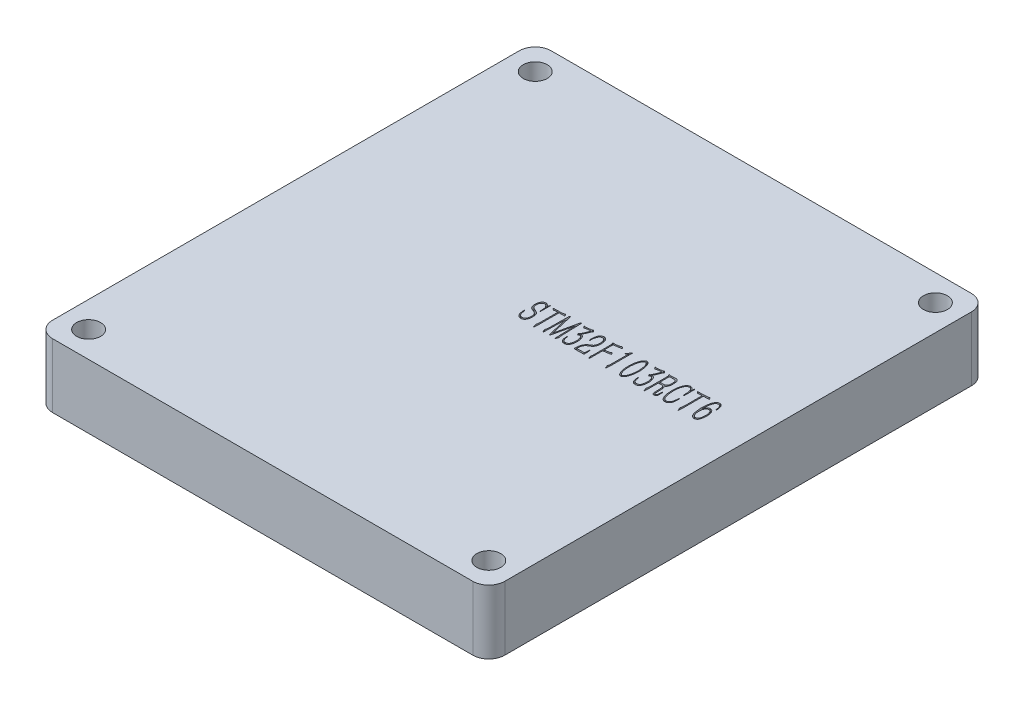
from build123d import *

# Parameters (mm, degrees)
SKETCH_1_W               = 56.5
SKETCH_1_H               = 62.3
EXTRUDE_1_DEPTH          = 8
SKETCH_2_R               = 1.5
CUT_EXTRUDE_1_DEPTH      = 43.806366349
MIRROR_2_COPY_1_SKETCH_R = 1.5
MIRROR_2_COPY_1_DEPTH    = 43.806366349
FILLET_1_R               = 2
CUT_EXTRUDE_2_DEPTH      = 4


with BuildPart() as part:
    # 草图1 → 凸台-拉伸1 (new body)
    with BuildSketch(Plane(origin=(0, 0, 0), x_dir=(1, 0, 0), z_dir=(0, 1, 0))):
        Rectangle(SKETCH_1_W, SKETCH_1_H)
    extrude(amount=EXTRUDE_1_DEPTH)

    # 草图2 → 切除-拉伸1 (cut, through all)
    with BuildSketch(Plane(origin=(0, 8, 0), x_dir=(1, 0, 0), z_dir=(0, 1, 0))):
        with Locations(Location((25, -27.9, 0), (0, 0, 270))):
            Circle(SKETCH_2_R)
    cut_extrude_1 = extrude(amount=-CUT_EXTRUDE_1_DEPTH, mode=Mode.SUBTRACT)

    # 镜向1: 切除-拉伸1 across plane
    add(cut_extrude_1.mirror(Plane.XY), mode=Mode.SUBTRACT)

    # 镜向2: 切除-拉伸1 across plane
    add(cut_extrude_1.mirror(Plane.ZY), mode=Mode.SUBTRACT)

    # 镜向2 copy 1 sketch → 镜向2 copy 1 (cut, through all)
    with BuildSketch(Plane(origin=(0, 8, 0), x_dir=(-1, 0, 0), z_dir=(0, 1, 0))):
        with Locations(Location((25, -27.9, 0), (0, 0, 270))):
            Circle(MIRROR_2_COPY_1_SKETCH_R)
    extrude(amount=-MIRROR_2_COPY_1_DEPTH, mode=Mode.SUBTRACT)

    # 圆角1
    fillet_1_edges = [part.edges().sort_by_distance(p)[0] for p in [
        (28.25, 4, 31.15),
        (-28.25, 4, 31.15),
        (-28.25, 4, -31.15),
        (28.25, 4, -31.15),
    ]]
    fillet(fillet_1_edges, radius=FILLET_1_R)

    # 草图3 → 切除-拉伸2 (cut)
    # profile 1 of 13: a face of its own
    with BuildSketch(Plane(origin=(0, 8, 0), x_dir=(1, 0, 0), z_dir=(0, 1, 0))):
        with BuildLine():
            Line((1.182825485, 3.201683358), (1.233539314, 3.508949499))
            Line((1.233539314, 3.508949499), (1.283507351, 3.503728958))
            Line((1.283507351, 3.503728958), (1.283507351, 2.245578521))
            Line((1.283507351, 2.245578521), (1.223098231, 2.24035798))
            Line((1.223098231, 2.24035798), (1.188046026, 2.773598977))
            add(Edge.make_bspline(
                [(1.188046026, 2.773598977), (1.183430907, 2.80325117), (1.174899715, 2.85806418), (1.158176767, 2.93229331), (1.142666199, 2.993037605), (1.118631816, 3.054596512), (1.08296612, 3.120318648), (1.030430718, 3.190762439), (0.967397662, 3.254217908), (0.892647847, 3.304134271), (0.811629789, 3.342284574), (0.753381177, 3.349535046), (0.72490944, 3.353079054)],
                knots=[0, 0, 0, 0, 1.116474761, 2.063838624, 2.831507158, 3.446633667, 4.518832044, 5.603216916, 6.708904972, 7.82779241, 8.938231816, 10, 10, 10, 10], degree=3))
            add(Edge.make_bspline(
                [(0.72490944, 3.353079054), (0.707946164, 3.352351944), (0.673118574, 3.350859101), (0.629400423, 3.340577131), (0.592141998, 3.326940696), (0.561329124, 3.309397013), (0.52743757, 3.285900502), (0.492033367, 3.256731768), (0.456433944, 3.223401837), (0.424860619, 3.184667405), (0.397143445, 3.142251526), (0.367421808, 3.081111429), (0.337825609, 3.003184689), (0.318260471, 2.922473311), (0.309708524, 2.855003165), (0.304455503, 2.798039637), (0.301082267, 2.734105457), (0.298122845, 2.664974585), (0.300666233, 2.593752929), (0.310928689, 2.524104559), (0.329405059, 2.457838821), (0.348005769, 2.416659039), (0.357234179, 2.396228425)],
                knots=[0, 0, 0, 0, 0.864038106, 1.773971445, 2.275285977, 2.88209936, 3.574564674, 4.376127188, 5.218616224, 6.055847121, 6.916999662, 7.795414815, 9.515900782, 11.157236165, 12.013901558, 12.981067707, 14.072720019, 15.277182195, 16.507433409, 17.699229733, 18.858513907, 20, 20, 20, 20], degree=3))
            add(Edge.make_bspline(
                [(0.357234179, 2.396228425), (0.367682642, 2.377282796), (0.388058744, 2.340335922), (0.426166865, 2.291146677), (0.47092121, 2.251279995), (0.533783798, 2.210662668), (0.609188839, 2.17436143), (0.668625354, 2.150358637), (0.695077775, 2.139676113)],
                knots=[0, 0, 0, 0, 0.892298636, 1.740118821, 2.553971753, 3.353728668, 4.822268012, 6, 6, 6, 6], degree=3))
            Line((0.695077775, 2.139676113), (0.871084594, 2.068825911))
            add(Edge.make_bspline(
                [(0.871084594, 2.068825911), (0.892799404, 2.058811418), (0.934609889, 2.039529148), (0.993537912, 2.008853773), (1.046889246, 1.978519895), (1.108275054, 1.937434397), (1.175914888, 1.883473272), (1.2427505, 1.8090532), (1.297060754, 1.724714163), (1.331127519, 1.626376041), (1.357958912, 1.519695633), (1.376075748, 1.403802617), (1.388037101, 1.277276955), (1.392844844, 1.141910388), (1.390715611, 1.002025675), (1.372834185, 0.910708671), (1.364052845, 0.865864053)],
                knots=[0, 0, 0, 0, 0.703245545, 1.354054533, 1.953549274, 2.507188807, 3.525842386, 4.488918984, 5.43838142, 6.454223102, 7.53246407, 8.673253088, 9.899948524, 11.268249991, 12.658472344, 14, 14, 14, 14], degree=3))
            add(Edge.make_bspline(
                [(1.364052845, 0.865864053), (1.353073428, 0.820890665), (1.331806965, 0.733779942), (1.28579642, 0.633696301), (1.245465219, 0.562923519), (1.21558694, 0.517057714), (1.185710536, 0.477642267), (1.146664176, 0.431385692), (1.086443708, 0.382624779), (1.016184674, 0.343796103), (0.951511524, 0.319655544), (0.897830479, 0.305854232), (0.840194007, 0.298858798), (0.800498685, 0.297515448), (0.780098018, 0.296825059)],
                knots=[0, 0, 0, 0, 1.868422262, 3.619020558, 4.429541533, 5.162879566, 5.830420081, 6.429075538, 7.606854402, 8.938752151, 9.657684361, 10.394048182, 11.174651193, 12, 12, 12, 12], degree=3))
            add(Edge.make_bspline(
                [(0.780098018, 0.296825059), (0.757189066, 0.296970793), (0.712349168, 0.29725604), (0.646745403, 0.307866885), (0.584837367, 0.327287462), (0.527187374, 0.356163334), (0.473269857, 0.392229355), (0.423194485, 0.435011802), (0.376882502, 0.484059214), (0.333150422, 0.538422811), (0.294844614, 0.599808915), (0.26023148, 0.666572218), (0.230625814, 0.739056074), (0.197433281, 0.841355083), (0.168265946, 0.971311068), (0.159923276, 1.076524632), (0.155870445, 1.127636906)],
                knots=[0, 0, 0, 0, 0.833862414, 1.63212638, 2.411403016, 3.189256699, 3.973153178, 4.770028097, 5.583768076, 6.428386665, 7.307987397, 8.215552436, 9.166047206, 10.157242313, 12.13320567, 14, 14, 14, 14], degree=3))
            Line((0.155870445, 1.127636906), (0.135734072, 1.3946303))
            Line((0.135734072, 1.3946303), (0.206584274, 1.3946303))
            add(Edge.make_bspline(
                [(0.206584274, 1.3946303), (0.210659798, 1.363037106), (0.218500529, 1.302256272), (0.232277286, 1.214579042), (0.245556342, 1.133757589), (0.262530756, 1.037168634), (0.289085521, 0.928060775), (0.330919784, 0.80948688), (0.385548972, 0.705428675), (0.443914042, 0.632330897), (0.49410611, 0.58147573), (0.534119945, 0.552278741), (0.573098417, 0.527056648), (0.625925498, 0.505484113), (0.691748064, 0.48824746), (0.744688791, 0.488413065), (0.770402727, 0.488493501)],
                knots=[0, 0, 0, 0, 1.134650933, 2.182907786, 3.161205505, 4.052250561, 5.675932663, 7.155002512, 8.52184542, 9.839854562, 10.472309825, 11.060302883, 11.600982628, 12.120735338, 13.087218943, 14, 14, 14, 14], degree=3))
            add(Edge.make_bspline(
                [(0.770402727, 0.488493501), (0.793099651, 0.489304778), (0.836638391, 0.490861024), (0.898901197, 0.504076227), (0.955618908, 0.524328366), (1.005593512, 0.555412913), (1.050411302, 0.592933441), (1.090851331, 0.636817386), (1.127914629, 0.686245301), (1.158821874, 0.741735734), (1.18610784, 0.799095389), (1.208533991, 0.856105748), (1.225169291, 0.911769493), (1.236447486, 0.966717478), (1.24409696, 1.023539638), (1.247995175, 1.084074614), (1.250838082, 1.149751642), (1.249272303, 1.19500594), (1.248455146, 1.218623482)],
                knots=[0, 0, 0, 0, 1.108065456, 2.12556444, 3.098260599, 4.035950869, 4.98490885, 5.94776606, 6.946521194, 7.996930623, 9.045863326, 10.049925535, 10.987930625, 11.881525266, 12.788809675, 13.787786499, 14.845478855, 16, 16, 16, 16], degree=3))
            add(Edge.make_bspline(
                [(1.248455146, 1.218623482), (1.24584417, 1.255485147), (1.24097098, 1.32428465), (1.225168363, 1.418976132), (1.205878012, 1.498512929), (1.180136628, 1.563889082), (1.148863277, 1.617939383), (1.115995955, 1.666521743), (1.078950784, 1.709842029), (1.036741737, 1.747579237), (0.99036972, 1.78256217), (0.938157128, 1.815093739), (0.879676732, 1.845996279), (0.837677647, 1.863569083), (0.815896015, 1.872682719)],
                knots=[0, 0, 0, 0, 1.578487453, 2.946127177, 4.097996722, 5.070650713, 5.936469873, 6.761635482, 7.575228913, 8.364955199, 9.176673428, 10.055112166, 10.991339211, 12, 12, 12, 12], degree=3))
            Line((0.815896015, 1.872682719), (0.598870658, 1.953228212))
            add(Edge.make_bspline(
                [(0.598870658, 1.953228212), (0.565099681, 1.967990748), (0.49817957, 1.997243988), (0.40683929, 2.056408314), (0.327248528, 2.128029793), (0.263156214, 2.214967928), (0.213938586, 2.316191112), (0.183869526, 2.411024148), (0.167121388, 2.496224453), (0.159669832, 2.568847603), (0.1547746, 2.648737502), (0.155493534, 2.704232275), (0.155870445, 2.733326231)],
                knots=[0, 0, 0, 0, 1.141640751, 2.262259852, 3.359181592, 4.444772656, 5.58953336, 6.835542724, 7.519006772, 8.279340868, 9.097919025, 10, 10, 10, 10], degree=3))
            add(Edge.make_bspline(
                [(0.155870445, 2.733326231), (0.156082987, 2.758443675), (0.15649385, 2.806997883), (0.161715713, 2.87724014), (0.170588485, 2.941977855), (0.186486501, 3.021011395), (0.214935165, 3.113825817), (0.259127536, 3.217730072), (0.310338264, 3.310538923), (0.369211201, 3.3883659), (0.436425592, 3.449215699), (0.49761986, 3.491340626), (0.553209802, 3.516359649), (0.600877239, 3.529887209), (0.653859033, 3.536775182), (0.690834558, 3.538096511), (0.709993608, 3.538781163)],
                knots=[0, 0, 0, 0, 0.971164436, 1.877345498, 2.721647718, 3.496542433, 4.992871533, 6.466013358, 7.856401207, 9.083219229, 10.219456221, 11.349985082, 11.939558551, 12.569451447, 13.258754286, 14, 14, 14, 14], degree=3))
            add(Edge.make_bspline(
                [(0.709993608, 3.538781163), (0.731467798, 3.536338314), (0.774177036, 3.531479821), (0.836821275, 3.514501635), (0.897422357, 3.490123868), (0.954018321, 3.457030636), (1.006069036, 3.420182142), (1.052903466, 3.381935078), (1.091182171, 3.340552444), (1.112247408, 3.311277004), (1.122416365, 3.297144684)],
                knots=[0, 0, 0, 0, 1.049956055, 2.088219507, 3.145806661, 4.218152357, 5.268178035, 6.24663062, 7.15358473, 8, 8, 8, 8], degree=3))
            Line((1.122416365, 3.297144684), (1.182825485, 3.201683358))
        make_face()
    # profile 2 of 13: a face of its own
    with BuildSketch(Plane(origin=(0, 8, 0), x_dir=(1, 0, 0), z_dir=(0, 1, 0))):
        with BuildLine():
            Line((2.594608992, 3.27700831), (2.594608992, 0.850948221))
            Line((2.594608992, 0.850948221), (2.569252078, 0.352759429))
            add(Edge.make_bspline(
                [(2.569252078, 0.352759429), (2.568953677, 0.328526754), (2.568418285, 0.285048252), (2.559988124, 0.235872886), (2.551798736, 0.205195923), (2.546045202, 0.193421132), (2.540576571, 0.183377391), (2.536042762, 0.185560512), (2.534199872, 0.186447901)],
                knots=[0, 0, 0, 0, 2.43675652, 4.372052466, 5.078871199, 5.550454925, 5.817270194, 6, 6, 6, 6], degree=3))
            add(Edge.make_bspline(
                [(2.534199872, 0.186447901), (2.531942801, 0.187126025), (2.526380494, 0.188797187), (2.515433264, 0.194906854), (2.504268935, 0.214131623), (2.493477328, 0.242766224), (2.481392759, 0.275232472), (2.476102655, 0.297524145), (2.473790752, 0.307266141)],
                knots=[0, 0, 0, 0, 0.30288637, 0.746430801, 1.570370807, 3.058663464, 4.714565407, 6, 6, 6, 6], degree=3))
            Line((2.473790752, 0.307266141), (2.413381632, 0.488493501))
            add(Edge.make_bspline(
                [(2.413381632, 0.488493501), (2.407604537, 0.504377342), (2.3974487, 0.532300322), (2.384958597, 0.568926768), (2.37836415, 0.595038699), (2.376318455, 0.618053157), (2.386450154, 0.642196695), (2.398467449, 0.673681002), (2.411843546, 0.710420734), (2.421706225, 0.751151079), (2.428001689, 0.795672054), (2.434223994, 0.84763895), (2.440190587, 0.912812409), (2.446792477, 0.994320586), (2.453455457, 1.091741778), (2.453585789, 1.161680794), (2.453654379, 1.198487108)],
                knots=[0, 0, 0, 0, 0.980641267, 1.723917205, 2.241620292, 2.544775778, 3.041991924, 3.722164793, 4.515637936, 5.302532678, 6.148880555, 7.121858782, 8.338588997, 9.944421189, 11.865699026, 14, 14, 14, 14], degree=3))
            Line((2.453654379, 1.198487108), (2.453654379, 3.272533561))
            add(Edge.make_bspline(
                [(2.453654379, 3.272533561), (2.439476844, 3.272471385), (2.413338879, 3.272356756), (2.379574481, 3.269745513), (2.347236224, 3.267832718), (2.30970371, 3.264720921), (2.257747659, 3.260245869), (2.197141592, 3.254424423), (2.137638589, 3.25021604), (2.090244103, 3.245241165), (2.059641562, 3.242980685), (2.044961102, 3.242195473), (2.04048583, 3.241956105)],
                knots=[0, 0, 0, 0, 1.025992475, 1.891538789, 2.450608741, 3.371279513, 4.617765367, 6.225964987, 7.778834079, 8.935698997, 9.675552692, 10, 10, 10, 10], degree=3))
            Line((2.04048583, 3.241956105), (1.939803963, 3.227040273))
            Line((1.939803963, 3.227040273), (1.769017686, 3.373215427))
            add(Edge.make_bspline(
                [(1.769017686, 3.373215427), (1.760917678, 3.381061954), (1.748402471, 3.393185513), (1.736618842, 3.41318982), (1.740210073, 3.426698574), (1.745626774, 3.437828557), (1.760711709, 3.443283433), (1.772030896, 3.443306324), (1.778712977, 3.443319838)],
                knots=[0, 0, 0, 0, 1.88901374, 2.918688365, 3.546721585, 4.117087209, 4.888455958, 6, 6, 6, 6], degree=3))
            add(Edge.make_bspline(
                [(1.778712977, 3.443319838), (1.781932231, 3.44248967), (1.792647129, 3.439726554), (1.816320568, 3.439813954), (1.853237803, 3.437376508), (1.88261038, 3.437835108), (1.899531217, 3.438099297)],
                knots=[0, 0, 0, 0, 0.328519165, 1.093436259, 2.325598431, 4, 4, 4, 4], degree=3))
            Line((1.899531217, 3.438099297), (1.98007671, 3.433624547))
            add(Edge.make_bspline(
                [(1.98007671, 3.433624547), (1.9830444, 3.432751657), (1.992490025, 3.429973404), (2.013488293, 3.432269771), (2.045694335, 3.430603528), (2.071302356, 3.432523914), (2.085979118, 3.433624547)],
                knots=[0, 0, 0, 0, 0.347341643, 1.105526146, 2.341086076, 4, 4, 4, 4], degree=3))
            Line((2.085979118, 3.433624547), (2.191881526, 3.433624547))
            Line((2.191881526, 3.433624547), (2.453654379, 3.443319838))
            Line((2.453654379, 3.443319838), (2.664713403, 3.448540379))
            add(Edge.make_bspline(
                [(2.664713403, 3.448540379), (2.682891587, 3.449209566), (2.725157384, 3.45076548), (2.793476764, 3.461936863), (2.869937284, 3.472591258), (2.934342788, 3.48027001), (2.981110375, 3.484179694), (3.007332084, 3.48904184), (3.025716566, 3.492520655), (3.034418966, 3.496902181), (3.037609205, 3.498508417)],
                knots=[0, 0, 0, 0, 1.156915626, 2.689925566, 4.399695503, 6.072075551, 6.820020126, 7.381954211, 7.77342877, 8, 8, 8, 8], degree=3))
            Line((3.037609205, 3.498508417), (3.143511613, 3.538781163))
            Line((3.143511613, 3.538781163), (3.288940976, 3.357553804))
            add(Edge.make_bspline(
                [(3.288940976, 3.357553804), (3.295664791, 3.34810777), (3.306306659, 3.333157414), (3.316635813, 3.313150933), (3.3179568, 3.300416367), (3.315616815, 3.291274729), (3.306294072, 3.288999454), (3.294486305, 3.289230886), (3.276271922, 3.286707177), (3.262088347, 3.287177498), (3.253888771, 3.287449393)],
                knots=[0, 0, 0, 0, 2.075716626, 3.285262792, 3.906827215, 4.383787294, 4.762155351, 5.472092002, 6.53860716, 8, 8, 8, 8], degree=3))
            Line((3.253888771, 3.287449393), (3.147986363, 3.287449393))
            Line((3.147986363, 3.287449393), (2.770615811, 3.282228851))
            add(Edge.make_bspline(
                [(2.770615811, 3.282228851), (2.751723372, 3.283080838), (2.717677029, 3.284616217), (2.672686442, 3.285277731), (2.639517585, 3.285283995), (2.621698211, 3.283086342), (2.614745365, 3.282228851)],
                knots=[0, 0, 0, 0, 1.454015493, 2.620302767, 3.461663352, 4, 4, 4, 4], degree=3))
            Line((2.614745365, 3.282228851), (2.594608992, 3.27700831))
        make_face()
    # profile 3 of 13: a face of its own
    with BuildSketch(Plane(origin=(0, 8, 0), x_dir=(1, 0, 0), z_dir=(0, 1, 0))):
        with BuildLine():
            Line((5.017685915, 3.564138078), (5.133283614, 3.564138078))
            Line((5.133283614, 3.564138078), (5.203388025, 1.202961858))
            Line((5.203388025, 1.202961858), (5.208608566, 0.981461752))
            add(Edge.make_bspline(
                [(5.208608566, 0.981461752), (5.208863475, 0.956848881), (5.209296477, 0.915040113), (5.21269486, 0.858907988), (5.220415264, 0.812151857), (5.230252342, 0.767698372), (5.243279994, 0.725472726), (5.256762913, 0.689199459), (5.270512823, 0.66265837), (5.277794397, 0.641619761), (5.274348164, 0.621491524), (5.268466822, 0.595935614), (5.254689207, 0.559115431), (5.244812087, 0.530276971), (5.239186022, 0.513850416)],
                knots=[0, 0, 0, 0, 1.833532234, 3.114538037, 4.183068399, 5.360011406, 6.502211209, 7.47535404, 8.229329157, 8.745810393, 9.081162989, 9.727925243, 10.705812996, 12, 12, 12, 12], degree=3))
            Line((5.239186022, 0.513850416), (5.183251651, 0.342318346))
            add(Edge.make_bspline(
                [(5.183251651, 0.342318346), (5.177104312, 0.326630641), (5.166240741, 0.298907348), (5.151351743, 0.26332067), (5.14089185, 0.2389551), (5.131043199, 0.223336553), (5.120513343, 0.215099906), (5.10784666, 0.212247221), (5.098139341, 0.220560858), (5.094881945, 0.227789177), (5.093010867, 0.231941189)],
                knots=[0, 0, 0, 0, 2.257142557, 3.988819353, 5.165733309, 5.812331029, 6.431774305, 6.935717094, 7.388666149, 8, 8, 8, 8], degree=3))
            add(Edge.make_bspline(
                [(5.093010867, 0.231941189), (5.089866112, 0.238043068), (5.081863694, 0.253570442), (5.081800779, 0.286341365), (5.08186506, 0.330162654), (5.085653674, 0.36368539), (5.087790326, 0.382591093)],
                knots=[0, 0, 0, 0, 0.533370556, 1.357261302, 2.50958371, 4, 4, 4, 4], degree=3))
            Line((5.087790326, 0.382591093), (5.078095035, 0.699552525))
            Line((5.078095035, 0.699552525), (5.017685915, 2.879501385))
            Line((5.017685915, 2.879501385), (4.453867462, 0.322181973))
            Line((4.453867462, 0.322181973), (4.357660345, 0.327402514))
            Line((4.357660345, 0.327402514), (3.749094396, 2.849669721))
            Line((3.749094396, 2.849669721), (3.708821649, 0.674941402))
            Line((3.708821649, 0.674941402), (3.698380567, 0.36245472))
            add(Edge.make_bspline(
                [(3.698380567, 0.36245472), (3.698258249, 0.339769126), (3.698039411, 0.299182343), (3.690807796, 0.252594548), (3.683671755, 0.223670105), (3.678185998, 0.210631779), (3.671825681, 0.200973036), (3.665985282, 0.201241571), (3.663328361, 0.201363733)],
                knots=[0, 0, 0, 0, 2.35867652, 4.21990684, 4.917432392, 5.427710553, 5.739653463, 6, 6, 6, 6], degree=3))
            add(Edge.make_bspline(
                [(3.663328361, 0.201363733), (3.659829355, 0.201962057), (3.652505178, 0.203214477), (3.638741069, 0.209418534), (3.628301369, 0.232818279), (3.619545174, 0.25849685), (3.61152449, 0.283570718), (3.607376699, 0.299607671), (3.603759685, 0.30986197), (3.603126292, 0.31521242), (3.602919241, 0.316961432)],
                knots=[0, 0, 0, 0, 0.61831469, 1.294266409, 2.516485019, 4.811391437, 6.122679461, 7.065853468, 7.69463614, 8, 8, 8, 8], degree=3))
            Line((3.602919241, 0.316961432), (3.511932666, 0.54368208))
            add(Edge.make_bspline(
                [(3.511932666, 0.54368208), (3.509476432, 0.55505692), (3.504652309, 0.577397472), (3.505552084, 0.612813446), (3.515080754, 0.650232305), (3.529288376, 0.689163439), (3.543743645, 0.724814928), (3.554012816, 0.750975703), (3.559844247, 0.770906506), (3.562063832, 0.791029901), (3.565458871, 0.817305643), (3.567094804, 0.848219704), (3.568954991, 0.879070463), (3.571637285, 0.905615171), (3.572662664, 0.925567045), (3.574456755, 0.939435613), (3.575552822, 0.951365487), (3.576199741, 0.965547192), (3.576728711, 0.985951019), (3.578769979, 1.012508794), (3.578764236, 1.045368678), (3.580996376, 1.084112562), (3.581062313, 1.129140179), (3.58218323, 1.161200142), (3.582782868, 1.178350735)],
                knots=[0, 0, 0, 0, 1.187984124, 2.333238898, 3.586201942, 5.123185855, 6.573707022, 7.523685523, 7.99901539, 8.693496643, 9.589827362, 10.711954829, 11.85946849, 12.753267707, 13.442133117, 13.902940376, 14.183976602, 14.668078378, 15.355532658, 16.272922794, 17.392740166, 18.716797284, 20.243638767, 22, 22, 22, 22], degree=3))
            Line((3.582782868, 1.178350735), (3.617835074, 3.564138078))
            Line((3.617835074, 3.564138078), (3.738653313, 3.564138078))
            Line((3.738653313, 3.564138078), (4.397933092, 0.715214149))
            Line((4.397933092, 0.715214149), (5.017685915, 3.564138078))
        make_face()
    # profile 4 of 13: a face of its own
    with BuildSketch(Plane(origin=(0, 8, 0), x_dir=(1, 0, 0), z_dir=(0, 1, 0))):
        with BuildLine():
            add(Edge.make_bspline(
                [(6.141593863, 2.310462391), (6.152765497, 2.333589435), (6.174286189, 2.378140663), (6.205676139, 2.442493606), (6.2349601, 2.501577682), (6.260006724, 2.556404139), (6.283361562, 2.605764243), (6.30416207, 2.65018641), (6.32213511, 2.689685164), (6.341056925, 2.733537238), (6.360681737, 2.779285126), (6.379680204, 2.824094015), (6.393496112, 2.856102037), (6.400638965, 2.873034953), (6.403366716, 2.879501385)],
                knots=[0, 0, 0, 0, 1.475873638, 2.843077615, 4.114458223, 5.26483622, 6.306479236, 7.252326145, 8.083448402, 8.799989154, 9.996708352, 10.943956596, 11.596712522, 12, 12, 12, 12], degree=3))
            Line((6.403366716, 2.879501385), (6.564457703, 3.307585766))
            add(Edge.make_bspline(
                [(6.564457703, 3.307585766), (6.529421546, 3.304157075), (6.45297438, 3.296675841), (6.355414323, 3.290735725), (6.274296631, 3.286409905), (6.218636026, 3.281745782), (6.169896218, 3.277386359), (6.139849227, 3.274069735), (6.12593224, 3.272533561)],
                knots=[0, 0, 0, 0, 1.440114021, 3.142257811, 3.998086789, 4.76330671, 5.427195687, 6, 6, 6, 6], degree=3))
            Line((6.12593224, 3.272533561), (5.975282335, 3.247176646))
            add(Edge.make_bspline(
                [(5.975282335, 3.247176646), (5.96855089, 3.245761471), (5.950185669, 3.241900485), (5.916222706, 3.231357329), (5.867309766, 3.218391681), (5.83008035, 3.207729147), (5.808970808, 3.201683358)],
                knots=[0, 0, 0, 0, 0.478461291, 1.305373098, 2.472113022, 4, 4, 4, 4], degree=3))
            Line((5.808970808, 3.201683358), (5.75900277, 3.181546985))
            Line((5.75900277, 3.181546985), (5.632963989, 3.367994886))
            add(Edge.make_bspline(
                [(5.632963989, 3.367994886), (5.627641791, 3.375294714), (5.618556232, 3.3877563), (5.611013599, 3.405091621), (5.605414801, 3.417134887), (5.610432837, 3.429262471), (5.630275626, 3.427443918), (5.645257232, 3.41680722), (5.664392933, 3.40657335), (5.686408984, 3.405134019), (5.713100235, 3.403567608), (5.732662583, 3.406607977), (5.743341146, 3.408267633)],
                knots=[0, 0, 0, 0, 1.323589942, 2.259509366, 2.829398404, 3.190947808, 3.965341466, 5.19662492, 6.050472624, 7.088782, 8.410843841, 10, 10, 10, 10], degree=3))
            Line((5.743341146, 3.408267633), (5.904432133, 3.413488174))
            Line((5.904432133, 3.413488174), (6.539100788, 3.488813126))
            Line((6.539100788, 3.488813126), (6.589068826, 3.534306414))
            Line((6.589068826, 3.534306414), (6.629341573, 3.57457916))
            add(Edge.make_bspline(
                [(6.629341573, 3.57457916), (6.630590549, 3.573092428), (6.635710657, 3.566997649), (6.646733334, 3.552494818), (6.666333196, 3.529194078), (6.681151564, 3.509776485), (6.689750693, 3.498508417)],
                knots=[0, 0, 0, 0, 0.23984028, 0.983211964, 2.249351781, 4, 4, 4, 4], degree=3))
            Line((6.689750693, 3.498508417), (6.78595781, 3.377690177))
            add(Edge.make_bspline(
                [(6.78595781, 3.377690177), (6.792418269, 3.369302134), (6.80315453, 3.355362537), (6.811119556, 3.333069109), (6.802957841, 3.317964796), (6.791556417, 3.305017661), (6.773074649, 3.289467159), (6.758431446, 3.27864613), (6.750159812, 3.272533561)],
                knots=[0, 0, 0, 0, 1.419029252, 2.358201718, 2.827787952, 3.596253847, 4.642174893, 6, 6, 6, 6], degree=3))
            Line((6.750159812, 3.272533561), (6.694971234, 3.227040273))
            add(Edge.make_bspline(
                [(6.694971234, 3.227040273), (6.678842699, 3.186506975), (6.64824107, 3.109600733), (6.604150185, 3.000149867), (6.563805224, 2.902832313), (6.528379553, 2.81679816), (6.495840575, 2.743025268), (6.468977727, 2.680427165), (6.44479242, 2.63020579), (6.42999942, 2.60080722), (6.42350309, 2.587896868)],
                knots=[0, 0, 0, 0, 1.507300768, 2.859891598, 4.076963614, 5.147345159, 6.074452096, 6.862861548, 7.500626815, 8, 8, 8, 8], degree=3))
            Line((6.42350309, 2.587896868), (6.272107394, 2.3007671))
            add(Edge.make_bspline(
                [(6.272107394, 2.3007671), (6.290002852, 2.302195946), (6.324275813, 2.304932439), (6.376580582, 2.31015627), (6.433569636, 2.302970936), (6.483553964, 2.282980329), (6.526081904, 2.25831345), (6.56015955, 2.233676087), (6.592715601, 2.20165441), (6.625912765, 2.164010589), (6.659187478, 2.119080736), (6.689775411, 2.064661457), (6.721617057, 2.002519508), (6.761438706, 1.907816173), (6.804467692, 1.781101178), (6.830611405, 1.621946436), (6.843528401, 1.462489754), (6.845424708, 1.356371069), (6.846366929, 1.303643725)],
                knots=[0, 0, 0, 0, 0.660541429, 1.265053373, 1.928435853, 2.750244091, 3.225390118, 3.735570922, 4.291687282, 4.900607759, 5.580848831, 6.342918567, 7.193367346, 8.147740655, 10.119512469, 12.097611575, 14.061014616, 16, 16, 16, 16], degree=3))
            add(Edge.make_bspline(
                [(6.846366929, 1.303643725), (6.844376567, 1.262363845), (6.840595518, 1.183945329), (6.831457618, 1.073133948), (6.817821206, 0.975918021), (6.797962104, 0.866315493), (6.762939124, 0.745226268), (6.719672677, 0.633510275), (6.678591837, 0.553025261), (6.643969823, 0.499656143), (6.60604884, 0.451910647), (6.565297798, 0.410128162), (6.522908307, 0.375791728), (6.481767368, 0.346261269), (6.440136915, 0.3253901), (6.386242565, 0.307954302), (6.320382381, 0.295935699), (6.267927578, 0.293527826), (6.24227573, 0.292350309)],
                knots=[0, 0, 0, 0, 1.512752116, 2.8737433, 4.067977017, 5.104892351, 6.948544146, 8.672095895, 9.482011449, 10.251829035, 10.996496654, 11.710742831, 12.38300564, 12.991319199, 13.561044299, 14.079002633, 15.060579187, 16, 16, 16, 16], degree=3))
            add(Edge.make_bspline(
                [(6.24227573, 0.292350309), (6.220395795, 0.291977356), (6.178301309, 0.291259836), (6.117244363, 0.296230338), (6.061634909, 0.307606906), (6.009482476, 0.323082986), (5.960640033, 0.347556614), (5.913986052, 0.3825171), (5.867020452, 0.425566915), (5.821989843, 0.478396905), (5.780777215, 0.538922579), (5.744741978, 0.605872242), (5.714801659, 0.678298085), (5.685037203, 0.781370017), (5.659809304, 0.913168693), (5.655314886, 1.019872451), (5.653100362, 1.072448327)],
                knots=[0, 0, 0, 0, 0.828828519, 1.594571005, 2.314948186, 2.97625877, 3.650192192, 4.371738268, 5.178272596, 6.059897072, 6.995131469, 7.947518938, 8.935744196, 9.957858231, 12.008325587, 14, 14, 14, 14], degree=3))
            Line((5.653100362, 1.072448327), (5.647879821, 1.268591519))
            Line((5.647879821, 1.268591519), (5.7030684, 1.268591519))
            add(Edge.make_bspline(
                [(5.7030684, 1.268591519), (5.707288597, 1.239505045), (5.71537065, 1.183801866), (5.727126924, 1.103436334), (5.739303237, 1.030177708), (5.753025599, 0.943483121), (5.775879756, 0.84613445), (5.814382042, 0.741361869), (5.866596533, 0.652835647), (5.927902775, 0.579883965), (5.999604078, 0.526931873), (6.076361511, 0.493530791), (6.154591189, 0.477760235), (6.206423415, 0.477956297), (6.231834647, 0.478052418)],
                knots=[0, 0, 0, 0, 0.994021113, 1.903638599, 2.746793397, 3.505624798, 4.871908371, 6.122639036, 7.264652637, 8.331625701, 9.323760524, 10.250011688, 11.142051883, 12, 12, 12, 12], degree=3))
            add(Edge.make_bspline(
                [(6.231834647, 0.478052418), (6.252277603, 0.479815268), (6.292316847, 0.483267958), (6.350378097, 0.49641271), (6.404073074, 0.518841707), (6.454267207, 0.54752351), (6.499446933, 0.584925568), (6.54010893, 0.628997405), (6.57454444, 0.681353691), (6.613136948, 0.761508139), (6.650642941, 0.872011634), (6.678863222, 1.012370412), (6.697226622, 1.155540092), (6.705853646, 1.297993223), (6.707029124, 1.438334289), (6.695489236, 1.530183148), (6.689750693, 1.57585766)],
                knots=[0, 0, 0, 0, 0.647840119, 1.268849254, 1.871153999, 2.479976942, 3.088343857, 3.716462885, 4.367721208, 5.059616847, 6.52246665, 8.039623249, 9.575767262, 11.078710543, 12.547304005, 14, 14, 14, 14], degree=3))
            add(Edge.make_bspline(
                [(6.689750693, 1.57585766), (6.681726511, 1.625088053), (6.66586455, 1.722405208), (6.629172774, 1.839214311), (6.593041607, 1.926438384), (6.560806334, 1.984958794), (6.524269058, 2.037231368), (6.482881623, 2.081073147), (6.440926372, 2.117050157), (6.398814489, 2.141056719), (6.357226785, 2.153409977), (6.330578332, 2.150694047), (6.317600682, 2.149371404)],
                knots=[0, 0, 0, 0, 2.019199264, 3.991492233, 4.943861116, 5.841091039, 6.693606335, 7.520378909, 8.278781735, 8.923571305, 9.475785111, 10, 10, 10, 10], degree=3))
            Line((6.317600682, 2.149371404), (6.237055189, 2.139676113))
            Line((6.237055189, 2.139676113), (6.202002983, 2.074046452))
            add(Edge.make_bspline(
                [(6.202002983, 2.074046452), (6.197324458, 2.065867362), (6.189168639, 2.0516092), (6.178023801, 2.032763121), (6.169122558, 2.021724539), (6.162366312, 2.01220847), (6.152599596, 2.015409688), (6.146317628, 2.026348658), (6.136275323, 2.042452355), (6.129742896, 2.056283081), (6.12593224, 2.064351161)],
                knots=[0, 0, 0, 0, 1.659028505, 2.892093886, 3.763458346, 4.288089223, 4.647361994, 5.327919393, 6.441255868, 8, 8, 8, 8], degree=3))
            Line((6.12593224, 2.064351161), (6.045386746, 2.220221607))
            add(Edge.make_bspline(
                [(6.045386746, 2.220221607), (6.039564761, 2.229180034), (6.029415382, 2.244797127), (6.033815412, 2.262599317), (6.035691455, 2.270189644)],
                knots=[0, 0, 0, 0, 1.147259222, 2, 2, 2, 2], degree=3))
            Line((6.035691455, 2.270189644), (6.075964202, 2.285851268))
            Line((6.075964202, 2.285851268), (6.141593863, 2.310462391))
        make_face()
    # profile 5 of 13: a face of its own
    with BuildSketch(Plane(origin=(0, 8, 0), x_dir=(1, 0, 0), z_dir=(0, 1, 0))):
        with BuildLine():
            Line((7.512358832, 2.235137439), (7.436288089, 2.235137439))
            add(Edge.make_bspline(
                [(7.436288089, 2.235137439), (7.434720685, 2.259246694), (7.431732553, 2.30520908), (7.42864921, 2.370848354), (7.427347098, 2.429784398), (7.426042681, 2.50163434), (7.42805442, 2.592246201), (7.433456108, 2.66523055), (7.436288089, 2.703494566)],
                knots=[0, 0, 0, 0, 0.927540379, 1.768282303, 2.522502339, 3.190652681, 4.527123766, 6, 6, 6, 6], degree=3))
            add(Edge.make_bspline(
                [(7.436288089, 2.703494566), (7.438247996, 2.731860844), (7.442038232, 2.786717974), (7.452041236, 2.86578048), (7.463617743, 2.939044855), (7.478668298, 3.00795541), (7.499004078, 3.07539127), (7.527954261, 3.143220124), (7.564060593, 3.213765189), (7.606719264, 3.284557134), (7.653525902, 3.351355017), (7.70606441, 3.405712266), (7.76105023, 3.447143463), (7.819553838, 3.471801339), (7.875725776, 3.48713502), (7.926949982, 3.499196594), (7.972981561, 3.507626005), (8.002064292, 3.508525605), (8.015768165, 3.508949499)],
                knots=[0, 0, 0, 0, 1.238521709, 2.395159043, 3.470603583, 4.46912877, 5.466066804, 6.534123646, 7.677244524, 8.916145015, 10.13365226, 11.221244199, 12.198275335, 13.109907183, 13.966820176, 14.733954848, 15.403435577, 16, 16, 16, 16], degree=3))
            add(Edge.make_bspline(
                [(8.015768165, 3.508949499), (8.033232361, 3.507661817), (8.06774107, 3.505117398), (8.118502427, 3.493328403), (8.167527478, 3.476330433), (8.230232173, 3.446050412), (8.30355522, 3.398575515), (8.365933599, 3.336233111), (8.409097666, 3.279166794), (8.439502518, 3.230598947), (8.466446016, 3.176366192), (8.500282119, 3.097564153), (8.535679388, 2.99299313), (8.561206089, 2.860919204), (8.577573181, 2.723766311), (8.585061647, 2.58355475), (8.586454047, 2.444725133), (8.578302313, 2.354182709), (8.574366077, 2.310462391)],
                knots=[0, 0, 0, 0, 0.570779476, 1.127842599, 1.694919432, 2.261066821, 3.397481896, 4.527710891, 5.118384485, 5.730727279, 6.394748858, 7.092559246, 8.529363642, 9.986910621, 11.474321506, 13.03467297, 14.568129345, 16, 16, 16, 16], degree=3))
            add(Edge.make_bspline(
                [(8.574366077, 2.310462391), (8.566386702, 2.265490143), (8.5503089, 2.174874655), (8.515679214, 2.065774856), (8.483383105, 1.982830893), (8.456381864, 1.927249988), (8.427531304, 1.8780454), (8.385813567, 1.8198561), (8.322105134, 1.753804739), (8.263068876, 1.709509932), (8.232047731, 1.686234818)],
                knots=[0, 0, 0, 0, 1.490916612, 3.004077927, 3.729534125, 4.397912905, 5.020560084, 5.590839424, 6.734084393, 8, 8, 8, 8], degree=3))
            Line((8.232047731, 1.686234818), (7.98519071, 1.530364372))
            add(Edge.make_bspline(
                [(7.98519071, 1.530364372), (7.953733705, 1.509008608), (7.894085222, 1.468514003), (7.81443803, 1.402367969), (7.747587529, 1.332671885), (7.697058435, 1.255608636), (7.657813523, 1.176282837), (7.622965291, 1.09663198), (7.596656647, 1.008838403), (7.577944916, 0.930146549), (7.565184135, 0.86405723), (7.558792005, 0.817965129), (7.553599264, 0.777228367), (7.55294065, 0.751771548), (7.552631579, 0.739825272)],
                knots=[0, 0, 0, 0, 1.453572249, 2.75625039, 3.953730064, 5.132566341, 6.263730064, 7.337486329, 8.453238547, 9.76321854, 10.430854957, 11.026567013, 11.543191201, 12, 12, 12, 12], degree=3))
            Line((7.552631579, 0.739825272), (7.542190496, 0.528766248))
            Line((7.542190496, 0.528766248), (8.443106755, 0.558597912))
            add(Edge.make_bspline(
                [(8.443106755, 0.558597912), (8.454667033, 0.559244276), (8.474971474, 0.560379549), (8.494485288, 0.581652936), (8.498828838, 0.607627757), (8.506536196, 0.639576038), (8.512266089, 0.68537105), (8.516686301, 0.720197403), (8.519177498, 0.739825272)],
                knots=[0, 0, 0, 0, 0.925905201, 1.626257371, 2.181371879, 3.087088273, 4.358305093, 6, 6, 6, 6], degree=3))
            Line((8.519177498, 0.739825272), (8.539313872, 1.178350735))
            Line((8.539313872, 1.178350735), (8.609418283, 1.178350735))
            Line((8.609418283, 1.178350735), (8.634775197, 0.513850416))
            add(Edge.make_bspline(
                [(8.634775197, 0.513850416), (8.635622892, 0.500931805), (8.637105512, 0.478337142), (8.637827232, 0.448447669), (8.63784766, 0.427635146), (8.637532891, 0.410831146), (8.632120701, 0.396139091), (8.627091688, 0.379091473), (8.60747398, 0.369460371), (8.579274917, 0.366378842), (8.536418612, 0.362014566), (8.502782764, 0.362293699), (8.483379501, 0.36245472)],
                knots=[0, 0, 0, 0, 1.385018147, 2.4223982, 3.193529914, 3.619812046, 4.200562765, 4.878496499, 5.402948042, 6.404258339, 7.925751149, 10, 10, 10, 10], degree=3))
            Line((8.483379501, 0.36245472), (7.481781377, 0.337097805))
            add(Edge.make_bspline(
                [(7.481781377, 0.337097805), (7.469605937, 0.337062186), (7.445607247, 0.336991979), (7.421014254, 0.360855954), (7.410690622, 0.390070097), (7.405523685, 0.424431793), (7.402062748, 0.470018386), (7.400400327, 0.548424524), (7.40395453, 0.659984411), (7.41196027, 0.752038836), (7.416151715, 0.800234392)],
                knots=[0, 0, 0, 0, 0.556373901, 1.096654043, 1.476064089, 2.012759395, 2.73145082, 3.635924119, 5.715166189, 8, 8, 8, 8], degree=3))
            add(Edge.make_bspline(
                [(7.416151715, 0.800234392), (7.419871275, 0.828366073), (7.427036439, 0.882557456), (7.441604894, 0.960563186), (7.457137229, 1.032969965), (7.473993913, 1.099733987), (7.492602862, 1.160503525), (7.512914478, 1.215209008), (7.533970599, 1.264731492), (7.565597984, 1.32075438), (7.605793928, 1.381821215), (7.651514607, 1.447665964), (7.695534717, 1.503519993), (7.753071147, 1.564968428), (7.830964457, 1.632040006), (7.896399792, 1.681151479), (7.930002131, 1.706371191)],
                knots=[0, 0, 0, 0, 1.103491021, 2.125706759, 3.085324024, 3.98349739, 4.803138144, 5.555704107, 6.252741852, 6.89323317, 8.054555834, 9.09539633, 10.010480884, 10.817709087, 12.365830683, 14, 14, 14, 14], degree=3))
            Line((7.930002131, 1.706371191), (8.136586405, 1.837630514))
            add(Edge.make_bspline(
                [(8.136586405, 1.837630514), (8.153125687, 1.848626833), (8.184864365, 1.869728635), (8.22870222, 1.903324416), (8.266075635, 1.938182427), (8.298282827, 1.975798774), (8.327438381, 2.019326222), (8.35138269, 2.073582504), (8.376696168, 2.137491181), (8.406210279, 2.236921139), (8.436641459, 2.368159943), (8.448307075, 2.530310654), (8.442075198, 2.694564249), (8.423023174, 2.803584263), (8.413275091, 2.859365012)],
                knots=[0, 0, 0, 0, 0.635613896, 1.219735276, 1.765761318, 2.268061313, 2.802129131, 3.435697723, 4.161225462, 5.001884758, 6.75303811, 8.46119913, 10.189351173, 12, 12, 12, 12], degree=3))
            add(Edge.make_bspline(
                [(8.413275091, 2.859365012), (8.405929745, 2.887802012), (8.391603881, 2.943263606), (8.364489141, 3.023158195), (8.329390771, 3.095924265), (8.291823254, 3.16389895), (8.244758257, 3.223400284), (8.182066971, 3.266134078), (8.108005724, 3.294700633), (8.053831788, 3.299731039), (8.025463456, 3.302365225)],
                knots=[0, 0, 0, 0, 1.101106684, 2.147523679, 3.156537618, 4.125318695, 5.058520457, 5.968677808, 6.93629249, 8, 8, 8, 8], degree=3))
            add(Edge.make_bspline(
                [(8.025463456, 3.302365225), (8.01053106, 3.302518101), (7.98074735, 3.302823024), (7.936385828, 3.296095723), (7.893238136, 3.281990405), (7.836559719, 3.256425299), (7.77106667, 3.208804424), (7.702130308, 3.13695355), (7.645268771, 3.049222068), (7.601489743, 2.947557282), (7.568571173, 2.831733376), (7.541847739, 2.701926242), (7.524300361, 2.556489771), (7.519397924, 2.45469517), (7.516833582, 2.401448967)],
                knots=[0, 0, 0, 0, 0.469335518, 0.936122588, 1.403629858, 1.893624907, 2.887406355, 3.927357629, 5.011993806, 6.157121359, 7.396943717, 8.794309501, 10.323183677, 12, 12, 12, 12], degree=3))
            Line((7.516833582, 2.401448967), (7.512358832, 2.235137439))
        make_face()
    # profile 6 of 13: a face of its own
    with BuildSketch(Plane(origin=(0, 8, 0), x_dir=(1, 0, 0), z_dir=(0, 1, 0))):
        with BuildLine():
            Line((9.426805881, 3.196462817), (9.426805881, 2.074046452))
            Line((9.426805881, 2.074046452), (9.824312806, 2.139676113))
            add(Edge.make_bspline(
                [(9.824312806, 2.139676113), (9.842475277, 2.142569866), (9.875130925, 2.147772757), (9.921932087, 2.156510771), (9.967464413, 2.166935371), (10.015390664, 2.179887068), (10.062958182, 2.193330437), (10.104078178, 2.208041841), (10.135871397, 2.223774942), (10.153538754, 2.235246651), (10.161410612, 2.24035798)],
                knots=[0, 0, 0, 0, 1.24603323, 2.240335181, 3.225032895, 4.409796613, 5.60362449, 6.573518241, 7.364417552, 8, 8, 8, 8], degree=3))
            Line((10.161410612, 2.24035798), (10.206903899, 2.270189644))
            Line((10.206903899, 2.270189644), (10.353079054, 2.11953974))
            add(Edge.make_bspline(
                [(10.353079054, 2.11953974), (10.358397879, 2.110951915), (10.367024841, 2.097022742), (10.372080677, 2.075415928), (10.366072044, 2.060291976), (10.358496205, 2.048073697), (10.34471247, 2.039392428), (10.333833562, 2.039137472), (10.327722139, 2.038994247)],
                knots=[0, 0, 0, 0, 1.656194662, 2.686294079, 3.458265774, 4.248254332, 5.015925316, 6, 6, 6, 6], degree=3))
            Line((10.327722139, 2.038994247), (9.426805881, 1.898039633))
            Line((9.426805881, 1.898039633), (9.426805881, 0.503409333))
            Line((9.426805881, 0.503409333), (9.42158534, 0.337097805))
            add(Edge.make_bspline(
                [(9.42158534, 0.337097805), (9.420798455, 0.32018116), (9.419429834, 0.290758186), (9.415299297, 0.253523034), (9.410472658, 0.229580015), (9.402907322, 0.215206968), (9.392060177, 0.212264546), (9.387728578, 0.215411157), (9.386533134, 0.216279565)],
                knots=[0, 0, 0, 0, 2.180560661, 3.792630331, 4.81750584, 5.323655776, 5.813341126, 6, 6, 6, 6], degree=3))
            add(Edge.make_bspline(
                [(9.386533134, 0.216279565), (9.382573412, 0.217989771), (9.372277447, 0.222436601), (9.361434921, 0.241932392), (9.348491803, 0.268294041), (9.340349988, 0.289978713), (9.335819305, 0.3020456)],
                knots=[0, 0, 0, 0, 0.496449437, 1.290854421, 2.492439647, 4, 4, 4, 4], degree=3))
            Line((9.335819305, 0.3020456), (9.295546559, 0.397506925))
            Line((9.295546559, 0.397506925), (9.265714895, 0.468357128))
            add(Edge.make_bspline(
                [(9.265714895, 0.468357128), (9.258292221, 0.482685179), (9.245962592, 0.506485171), (9.245687859, 0.533092766), (9.245578521, 0.54368208)],
                knots=[0, 0, 0, 0, 1.204038306, 2, 2, 2, 2], degree=3))
            add(Edge.make_bspline(
                [(9.245578521, 0.54368208), (9.246452802, 0.549427766), (9.248926949, 0.565687626), (9.258755472, 0.594272679), (9.269463789, 0.631802954), (9.278657893, 0.67663921), (9.285421604, 0.728952395), (9.288267566, 0.787535369), (9.290046408, 0.844592782), (9.29388641, 0.880791652), (9.295546559, 0.896441509)],
                knots=[0, 0, 0, 0, 0.389499692, 1.102254739, 2.021257159, 3.009443074, 4.170413774, 5.557723895, 6.944130786, 8, 8, 8, 8], degree=3))
            Line((9.295546559, 0.896441509), (9.290326017, 1.208182399))
            Line((9.290326017, 1.208182399), (9.290326017, 3.171851694))
            add(Edge.make_bspline(
                [(9.290326017, 3.171851694), (9.280952678, 3.190917545), (9.263317525, 3.226788347), (9.233941018, 3.274283234), (9.211699225, 3.315022366), (9.196684383, 3.349089346), (9.192379325, 3.374949815), (9.189293213, 3.395267759), (9.201766001, 3.409740434), (9.213381578, 3.412099184), (9.220221607, 3.413488174)],
                knots=[0, 0, 0, 0, 1.807274104, 3.400234877, 4.744322034, 5.769722147, 6.524877954, 7.011486452, 7.41789706, 8, 8, 8, 8], degree=3))
            Line((9.220221607, 3.413488174), (9.295546559, 3.403047091))
            Line((9.295546559, 3.403047091), (9.416364799, 3.388131259))
            add(Edge.make_bspline(
                [(9.416364799, 3.388131259), (9.432772885, 3.388053661), (9.463105204, 3.387910212), (9.504618197, 3.388802884), (9.538428167, 3.389597351), (9.572805656, 3.390225529), (9.60894213, 3.393642739), (9.635679748, 3.400030578), (9.648305988, 3.403047091)],
                knots=[0, 0, 0, 0, 1.267132572, 2.342446765, 3.206614087, 3.878852545, 4.998335737, 6, 6, 6, 6], degree=3))
            Line((9.648305988, 3.403047091), (9.849669721, 3.438099297))
            Line((9.849669721, 3.438099297), (9.950351587, 3.453760921))
            add(Edge.make_bspline(
                [(9.950351587, 3.453760921), (9.964324305, 3.455990049), (9.99307554, 3.460576859), (10.03651702, 3.47271149), (10.079615805, 3.4895975), (10.121914691, 3.504853835), (10.157978293, 3.520674609), (10.178169566, 3.533373606), (10.186767526, 3.538781163)],
                knots=[0, 0, 0, 0, 1.007293543, 2.072677319, 3.204281805, 4.302704065, 5.277248016, 6, 6, 6, 6], degree=3))
            Line((10.186767526, 3.538781163), (10.232260814, 3.564138078))
            Line((10.232260814, 3.564138078), (10.377690177, 3.417962924))
            add(Edge.make_bspline(
                [(10.377690177, 3.417962924), (10.384800508, 3.409617501), (10.396538629, 3.395840425), (10.399630953, 3.37157213), (10.393415648, 3.356148447), (10.386109508, 3.343640458), (10.370812777, 3.33831675), (10.359789084, 3.337757712), (10.353079054, 3.33741743)],
                knots=[0, 0, 0, 0, 1.680784027, 2.774729269, 3.597885292, 4.266236666, 4.944672705, 6, 6, 6, 6], degree=3))
            Line((10.353079054, 3.33741743), (10.272533561, 3.327722139))
            Line((10.272533561, 3.327722139), (9.945131046, 3.272533561))
            Line((9.945131046, 3.272533561), (9.426805881, 3.196462817))
        make_face()
    # profile 7 of 13: a face of its own
    with BuildSketch(Plane(origin=(0, 8, 0), x_dir=(1, 0, 0), z_dir=(0, 1, 0))):
        with BuildLine():
            Line((11.487428084, 3.534306414), (11.542616663, 3.534306414))
            Line((11.542616663, 3.534306414), (11.537396122, 0.860643512))
            add(Edge.make_bspline(
                [(11.537396122, 0.860643512), (11.536801404, 0.836531223), (11.5356611, 0.790298592), (11.535568555, 0.724151689), (11.533393143, 0.664261802), (11.533219871, 0.610543188), (11.53160227, 0.563066024), (11.52973167, 0.521820374), (11.529553927, 0.486728926), (11.52624517, 0.431806279), (11.522302348, 0.356291737), (11.512524352, 0.278513041), (11.504740333, 0.223092466), (11.496827235, 0.197864051), (11.486802152, 0.177902503), (11.476797139, 0.180230387), (11.472512252, 0.18122736)],
                knots=[0, 0, 0, 0, 1.45038606, 2.780953852, 3.977268029, 5.053718292, 6.010937745, 6.833690271, 7.536464333, 8.120251454, 10.142880859, 12.069479857, 12.873132744, 13.440417135, 13.76034519, 14, 14, 14, 14], degree=3))
            add(Edge.make_bspline(
                [(11.472512252, 0.18122736), (11.471521723, 0.181977123), (11.467282016, 0.18518629), (11.457171489, 0.191978917), (11.445158097, 0.210186957), (11.439899386, 0.226522015), (11.436714255, 0.236415939)],
                knots=[0, 0, 0, 0, 0.221265066, 0.947068446, 2.150880552, 4, 4, 4, 4], degree=3))
            Line((11.436714255, 0.236415939), (11.412103132, 0.3020456))
            Line((11.412103132, 0.3020456), (11.356168762, 0.48327296))
            add(Edge.make_bspline(
                [(11.356168762, 0.48327296), (11.34943547, 0.500324587), (11.337706423, 0.530027641), (11.325874404, 0.569106135), (11.316898235, 0.594059404), (11.314512442, 0.614285114), (11.326004819, 0.633256883), (11.334468561, 0.662467624), (11.347491999, 0.699753211), (11.359790584, 0.743760308), (11.370653136, 0.791309282), (11.380438401, 0.842684453), (11.385983991, 0.900567186), (11.388704319, 0.955833044), (11.390792009, 1.009042479), (11.39117131, 1.060268342), (11.392217473, 1.120921331), (11.392054043, 1.164677216), (11.391966759, 1.188046026)],
                knots=[0, 0, 0, 0, 1.220359697, 2.125803599, 2.712350858, 2.994193817, 3.439826662, 4.12562012, 5.031064022, 6.063176816, 7.167225426, 8.277459231, 9.542238136, 11.034069985, 11.961482632, 13.08703073, 14.444263491, 16, 16, 16, 16], degree=3))
            Line((11.391966759, 1.188046026), (11.396441509, 3.161410612))
            Line((11.396441509, 3.161410612), (11.134668655, 2.934689964))
            Line((11.134668655, 2.934689964), (11.114532282, 3.020455998))
            add(Edge.make_bspline(
                [(11.114532282, 3.020455998), (11.135810721, 3.042443117), (11.175698032, 3.083658879), (11.229005161, 3.143002168), (11.272848409, 3.194502744), (11.318514077, 3.254709329), (11.369642003, 3.32963605), (11.407398362, 3.39119403), (11.427018964, 3.423183465)],
                knots=[0, 0, 0, 0, 1.077185482, 2.019228619, 2.808185376, 3.45765616, 4.678836699, 6, 6, 6, 6], degree=3))
            Line((11.427018964, 3.423183465), (11.487428084, 3.534306414))
        make_face()
    # profile 8 of 13: a face of its own
    with BuildSketch(Plane(origin=(0, 8, 0), x_dir=(1, 0, 0), z_dir=(0, 1, 0))):
        with BuildLine():
            add(Edge.make_bspline(
                [(12.686660984, 1.963669295), (12.689091376, 2.011916283), (12.694070792, 2.110765322), (12.707607276, 2.262277547), (12.727574032, 2.42033994), (12.750727857, 2.582666916), (12.782766511, 2.743023265), (12.82376999, 2.895520822), (12.876114206, 3.036517987), (12.928345545, 3.144785752), (12.972499545, 3.224166335), (13.004625795, 3.27697221), (13.035189449, 3.324594112), (13.065301661, 3.365968733), (13.094856896, 3.401200186), (13.122114322, 3.431748842), (13.149623113, 3.455532441), (13.184123121, 3.479116059), (13.226117066, 3.500150145), (13.274780192, 3.518551143), (13.32160476, 3.529195535), (13.352108658, 3.529121557), (13.366822928, 3.529085873)],
                knots=[0, 0, 0, 0, 1.583211401, 3.243703523, 4.983978234, 6.804605119, 8.6166428, 10.340282122, 11.974804003, 13.53820457, 14.274983449, 14.951299633, 15.563740824, 16.129235462, 16.626851747, 17.070813204, 17.469389546, 17.815167281, 18.438300608, 19.002855301, 19.519003895, 20, 20, 20, 20], degree=3))
            add(Edge.make_bspline(
                [(13.366822928, 3.529085873), (13.380893114, 3.526625539), (13.410611538, 3.521428931), (13.454547494, 3.502106932), (13.501179184, 3.47641084), (13.550792861, 3.443106424), (13.600327397, 3.398326835), (13.64623409, 3.339017562), (13.688852731, 3.266584216), (13.741815333, 3.151947274), (13.800178328, 2.9965647), (13.846004662, 2.833415232), (13.875772021, 2.697193015), (13.895185102, 2.5885097), (13.910621608, 2.473262019), (13.927197967, 2.311246191), (13.941981033, 2.103638617), (13.944363611, 1.936352025), (13.945557213, 1.852546346)],
                knots=[0, 0, 0, 0, 0.36369769, 0.768186139, 1.217229854, 1.724510149, 2.290946358, 2.914777825, 3.632489608, 4.433551378, 6.137860108, 7.866765886, 8.757390638, 9.699141408, 10.686159515, 11.726895222, 13.859299765, 16, 16, 16, 16], degree=3))
            add(Edge.make_bspline(
                [(13.945557213, 1.852546346), (13.94099167, 1.785393774), (13.931608528, 1.64738123), (13.909286572, 1.436009466), (13.872471551, 1.21611746), (13.826144514, 1.030890159), (13.781334743, 0.8834096), (13.743334507, 0.77698901), (13.700816437, 0.676489996), (13.65543644, 0.582886514), (13.608227085, 0.499562292), (13.559358273, 0.429545814), (13.507718743, 0.37561904), (13.454665901, 0.336883407), (13.402866613, 0.310632835), (13.353372647, 0.293848585), (13.306239365, 0.284532081), (13.275616322, 0.286287401), (13.26092052, 0.287129768)],
                knots=[0, 0, 0, 0, 1.760488992, 3.618172134, 5.557361062, 7.587083219, 8.607294374, 9.588398617, 10.541277716, 11.460251193, 12.307925722, 13.044175775, 13.687957546, 14.251129358, 14.754223989, 15.200440537, 15.616296545, 16, 16, 16, 16], degree=3))
            add(Edge.make_bspline(
                [(13.26092052, 0.287129768), (13.246878272, 0.289103623), (13.217292339, 0.293262383), (13.172695957, 0.310762936), (13.126254731, 0.337726576), (13.076675525, 0.373270194), (13.026752005, 0.422101799), (12.978678598, 0.485262113), (12.932576844, 0.563094332), (12.888764909, 0.654113663), (12.847614817, 0.755493705), (12.811582724, 0.864884335), (12.778199705, 0.979835685), (12.751450916, 1.100023362), (12.729439494, 1.221492376), (12.712168923, 1.340890905), (12.700050854, 1.45682214), (12.693511048, 1.568823693), (12.691224249, 1.676039394), (12.688807428, 1.777462924), (12.687295491, 1.872678731), (12.686867279, 1.934085829), (12.686660984, 1.963669295)],
                knots=[0, 0, 0, 0, 0.451175502, 0.950591959, 1.515271951, 2.162531354, 2.891688268, 3.734081857, 4.687580886, 5.773002708, 6.954198864, 8.17563603, 9.445923076, 10.771603705, 12.101713585, 13.383756751, 14.619631726, 15.819374781, 16.961914306, 18.040825747, 19.056148764, 20, 20, 20, 20], degree=3))
        make_face()
        with BuildLine():
            add(Edge.make_bspline(
                [(12.817920307, 1.953228212), (12.817389562, 1.929115395), (12.816262515, 1.877911351), (12.815190657, 1.796358269), (12.81719028, 1.705611682), (12.820606978, 1.571701132), (12.833150993, 1.396696846), (12.865211211, 1.18659613), (12.910999335, 0.983130277), (12.961453713, 0.823690994), (13.008426349, 0.710032777), (13.044471141, 0.639492391), (13.082391566, 0.58250538), (13.122120682, 0.53909791), (13.162307673, 0.508335728), (13.1998639, 0.486353728), (13.235453097, 0.471259259), (13.259304415, 0.469290706), (13.270615811, 0.468357128)],
                knots=[0, 0, 0, 0, 0.705717407, 1.498604912, 2.386138873, 3.361274458, 5.418191474, 7.514713171, 9.57394393, 11.515405308, 12.398906158, 13.169972934, 13.829695216, 14.395845116, 14.883250105, 15.303691084, 15.669778158, 16, 16, 16, 16], degree=3))
            add(Edge.make_bspline(
                [(13.270615811, 0.468357128), (13.281087624, 0.468491815), (13.303580937, 0.468781121), (13.33877278, 0.477244153), (13.375769754, 0.495059118), (13.416807706, 0.518469537), (13.458966954, 0.554498803), (13.500578883, 0.603736902), (13.541364849, 0.666841207), (13.582041219, 0.741460044), (13.620518113, 0.824477855), (13.654985314, 0.912432283), (13.684981015, 1.003225809), (13.717421622, 1.130252092), (13.750772129, 1.295000275), (13.780728507, 1.496184719), (13.800594572, 1.694581327), (13.808867742, 1.856435017), (13.811169023, 1.984551495), (13.809256524, 2.086501298), (13.805648164, 2.195904192), (13.801516557, 2.271439057), (13.799382058, 2.310462391)],
                knots=[0, 0, 0, 0, 0.308126263, 0.661851094, 1.055455993, 1.515432549, 2.051181639, 2.679899785, 3.409545513, 4.262246801, 5.183512362, 6.104777924, 7.045624675, 8.000099589, 9.967578284, 11.997814557, 13.993544283, 15.842664909, 16.77344086, 17.770161498, 18.848005724, 20, 20, 20, 20], degree=3))
            add(Edge.make_bspline(
                [(13.799382058, 2.310462391), (13.795785237, 2.347019313), (13.788803859, 2.417975773), (13.776530072, 2.520524509), (13.761299627, 2.615699345), (13.739838816, 2.732952752), (13.705195437, 2.87364507), (13.657476632, 3.007588406), (13.616319718, 3.108716895), (13.580944177, 3.172791339), (13.54496446, 3.227168137), (13.504981943, 3.268664486), (13.46606352, 3.301001068), (13.429434018, 3.325169526), (13.395221936, 3.342233615), (13.372183736, 3.346088144), (13.361602387, 3.347858513)],
                knots=[0, 0, 0, 0, 1.302834758, 2.528783491, 3.662347304, 4.720685654, 6.75648594, 8.792057095, 9.759925264, 10.624039914, 11.384659521, 12.06448684, 12.659424566, 13.175428451, 13.621277708, 14, 14, 14, 14], degree=3))
            add(Edge.make_bspline(
                [(13.361602387, 3.347858513), (13.350099916, 3.347021491), (13.325929134, 3.345262611), (13.289030242, 3.333952444), (13.249866624, 3.316267078), (13.206839983, 3.291735407), (13.162018535, 3.252362379), (13.116760841, 3.194728404), (13.069930908, 3.118280758), (13.021052995, 3.024173783), (12.974351434, 2.913297122), (12.9346724, 2.786297878), (12.900384486, 2.645324535), (12.874557987, 2.494351686), (12.85369535, 2.343252376), (12.837428333, 2.201227145), (12.824966248, 2.072702497), (12.820179094, 1.99152926), (12.817920307, 1.953228212)],
                knots=[0, 0, 0, 0, 0.347392606, 0.729995465, 1.156884588, 1.644891073, 2.219813456, 2.945627096, 3.849684979, 4.924243867, 6.145708801, 7.477723151, 8.938118981, 10.524254447, 12.100980159, 13.544449593, 14.841364989, 16, 16, 16, 16], degree=3))
        make_face(mode=Mode.SUBTRACT)
    # profile 9 of 13: a face of its own
    with BuildSketch(Plane(origin=(0, 8, 0), x_dir=(1, 0, 0), z_dir=(0, 1, 0))):
        with BuildLine():
            add(Edge.make_bspline(
                [(15.019497123, 2.310462391), (15.030668757, 2.333589435), (15.05218945, 2.378140663), (15.083579399, 2.442493606), (15.11286336, 2.501577682), (15.137909984, 2.556404139), (15.161264822, 2.605764243), (15.18206533, 2.65018641), (15.20003837, 2.689685164), (15.218960185, 2.733537238), (15.238584998, 2.779285126), (15.257583464, 2.824094015), (15.271399372, 2.856102037), (15.278542226, 2.873034953), (15.281269977, 2.879501385)],
                knots=[0, 0, 0, 0, 1.475873638, 2.843077615, 4.114458223, 5.26483622, 6.306479236, 7.252326145, 8.083448402, 8.799989154, 9.996708352, 10.943956596, 11.596712522, 12, 12, 12, 12], degree=3))
            Line((15.281269977, 2.879501385), (15.442360963, 3.307585766))
            add(Edge.make_bspline(
                [(15.442360963, 3.307585766), (15.407324807, 3.304157075), (15.33087764, 3.296675841), (15.233317583, 3.290735725), (15.152199891, 3.286409905), (15.096539286, 3.281745782), (15.047799478, 3.277386359), (15.017752488, 3.274069735), (15.0038355, 3.272533561)],
                knots=[0, 0, 0, 0, 1.440114021, 3.142257811, 3.998086789, 4.76330671, 5.427195687, 6, 6, 6, 6], degree=3))
            Line((15.0038355, 3.272533561), (14.853185596, 3.247176646))
            add(Edge.make_bspline(
                [(14.853185596, 3.247176646), (14.846454151, 3.245761471), (14.82808893, 3.241900485), (14.794125966, 3.231357329), (14.745213026, 3.218391681), (14.70798361, 3.207729147), (14.686874068, 3.201683358)],
                knots=[0, 0, 0, 0, 0.478461291, 1.305373098, 2.472113022, 4, 4, 4, 4], degree=3))
            Line((14.686874068, 3.201683358), (14.63690603, 3.181546985))
            Line((14.63690603, 3.181546985), (14.510867249, 3.367994886))
            add(Edge.make_bspline(
                [(14.510867249, 3.367994886), (14.505545051, 3.375294714), (14.496459492, 3.3877563), (14.488916859, 3.405091621), (14.483318061, 3.417134887), (14.488336097, 3.429262471), (14.508178886, 3.427443918), (14.523160493, 3.41680722), (14.542296193, 3.40657335), (14.564312244, 3.405134019), (14.591003495, 3.403567608), (14.610565843, 3.406607977), (14.621244407, 3.408267633)],
                knots=[0, 0, 0, 0, 1.323589942, 2.259509366, 2.829398404, 3.190947808, 3.965341466, 5.19662492, 6.050472624, 7.088782, 8.410843841, 10, 10, 10, 10], degree=3))
            Line((14.621244407, 3.408267633), (14.782335393, 3.413488174))
            Line((14.782335393, 3.413488174), (15.417004049, 3.488813126))
            Line((15.417004049, 3.488813126), (15.466972086, 3.534306414))
            Line((15.466972086, 3.534306414), (15.507244833, 3.57457916))
            add(Edge.make_bspline(
                [(15.507244833, 3.57457916), (15.508493809, 3.573092428), (15.513613917, 3.566997649), (15.524636594, 3.552494818), (15.544236456, 3.529194078), (15.559054824, 3.509776485), (15.567653953, 3.498508417)],
                knots=[0, 0, 0, 0, 0.23984028, 0.983211964, 2.249351781, 4, 4, 4, 4], degree=3))
            Line((15.567653953, 3.498508417), (15.66386107, 3.377690177))
            add(Edge.make_bspline(
                [(15.66386107, 3.377690177), (15.67032153, 3.369302134), (15.68105779, 3.355362537), (15.689022816, 3.333069109), (15.680861101, 3.317964796), (15.669459678, 3.305017661), (15.650977909, 3.289467159), (15.636334706, 3.27864613), (15.628063073, 3.272533561)],
                knots=[0, 0, 0, 0, 1.419029252, 2.358201718, 2.827787952, 3.596253847, 4.642174893, 6, 6, 6, 6], degree=3))
            Line((15.628063073, 3.272533561), (15.572874494, 3.227040273))
            add(Edge.make_bspline(
                [(15.572874494, 3.227040273), (15.55674596, 3.186506975), (15.52614433, 3.109600733), (15.482053445, 3.000149867), (15.441708484, 2.902832313), (15.406282813, 2.81679816), (15.373743836, 2.743025268), (15.346880987, 2.680427165), (15.32269568, 2.63020579), (15.307902681, 2.60080722), (15.30140635, 2.587896868)],
                knots=[0, 0, 0, 0, 1.507300768, 2.859891598, 4.076963614, 5.147345159, 6.074452096, 6.862861548, 7.500626815, 8, 8, 8, 8], degree=3))
            Line((15.30140635, 2.587896868), (15.150010654, 2.3007671))
            add(Edge.make_bspline(
                [(15.150010654, 2.3007671), (15.167906113, 2.302195946), (15.202179073, 2.304932439), (15.254483843, 2.31015627), (15.311472896, 2.302970936), (15.361457225, 2.282980329), (15.403985164, 2.25831345), (15.43806281, 2.233676087), (15.470618861, 2.20165441), (15.503816025, 2.164010589), (15.537090738, 2.119080736), (15.567678671, 2.064661457), (15.599520318, 2.002519508), (15.639341966, 1.907816173), (15.682370953, 1.781101178), (15.708514665, 1.621946436), (15.721431661, 1.462489754), (15.723327968, 1.356371069), (15.72427019, 1.303643725)],
                knots=[0, 0, 0, 0, 0.660541429, 1.265053373, 1.928435853, 2.750244091, 3.225390118, 3.735570922, 4.291687282, 4.900607759, 5.580848831, 6.342918567, 7.193367346, 8.147740655, 10.119512469, 12.097611575, 14.061014616, 16, 16, 16, 16], degree=3))
            add(Edge.make_bspline(
                [(15.72427019, 1.303643725), (15.722279827, 1.262363845), (15.718498778, 1.183945329), (15.709360878, 1.073133948), (15.695724466, 0.975918021), (15.675865364, 0.866315493), (15.640842384, 0.745226268), (15.597575937, 0.633510275), (15.556495098, 0.553025261), (15.521873083, 0.499656143), (15.4839521, 0.451910647), (15.443201058, 0.410128162), (15.400811568, 0.375791728), (15.359670629, 0.346261269), (15.318040175, 0.3253901), (15.264145825, 0.307954302), (15.198285642, 0.295935699), (15.145830839, 0.293527826), (15.12017899, 0.292350309)],
                knots=[0, 0, 0, 0, 1.512752116, 2.8737433, 4.067977017, 5.104892351, 6.948544146, 8.672095895, 9.482011449, 10.251829035, 10.996496654, 11.710742831, 12.38300564, 12.991319199, 13.561044299, 14.079002633, 15.060579187, 16, 16, 16, 16], degree=3))
            add(Edge.make_bspline(
                [(15.12017899, 0.292350309), (15.098299055, 0.291977356), (15.05620457, 0.291259836), (14.995147623, 0.296230338), (14.939538169, 0.307606906), (14.887385736, 0.323082986), (14.838543293, 0.347556614), (14.791889312, 0.3825171), (14.744923713, 0.425566915), (14.699893103, 0.478396905), (14.658680475, 0.538922579), (14.622645239, 0.605872242), (14.592704919, 0.678298085), (14.562940463, 0.781370017), (14.537712564, 0.913168693), (14.533218146, 1.019872451), (14.531003622, 1.072448327)],
                knots=[0, 0, 0, 0, 0.828828519, 1.594571005, 2.314948186, 2.97625877, 3.650192192, 4.371738268, 5.178272596, 6.059897072, 6.995131469, 7.947518938, 8.935744196, 9.957858231, 12.008325587, 14, 14, 14, 14], degree=3))
            Line((14.531003622, 1.072448327), (14.525783081, 1.268591519))
            Line((14.525783081, 1.268591519), (14.58097166, 1.268591519))
            add(Edge.make_bspline(
                [(14.58097166, 1.268591519), (14.585191857, 1.239505045), (14.59327391, 1.183801866), (14.605030185, 1.103436334), (14.617206497, 1.030177708), (14.63092886, 0.943483121), (14.653783017, 0.84613445), (14.692285302, 0.741361869), (14.744499793, 0.652835647), (14.805806036, 0.579883965), (14.877507339, 0.526931873), (14.954264771, 0.493530791), (15.03249445, 0.477760235), (15.084326675, 0.477956297), (15.109737908, 0.478052418)],
                knots=[0, 0, 0, 0, 0.994021113, 1.903638599, 2.746793397, 3.505624798, 4.871908371, 6.122639036, 7.264652637, 8.331625701, 9.323760524, 10.250011688, 11.142051883, 12, 12, 12, 12], degree=3))
            add(Edge.make_bspline(
                [(15.109737908, 0.478052418), (15.130180863, 0.479815268), (15.170220107, 0.483267958), (15.228281357, 0.49641271), (15.281976334, 0.518841707), (15.332170467, 0.54752351), (15.377350193, 0.584925568), (15.41801219, 0.628997405), (15.4524477, 0.681353691), (15.491040208, 0.761508139), (15.528546201, 0.872011634), (15.556766482, 1.012370412), (15.575129882, 1.155540092), (15.583756906, 1.297993223), (15.584932384, 1.438334289), (15.573392497, 1.530183148), (15.567653953, 1.57585766)],
                knots=[0, 0, 0, 0, 0.647840119, 1.268849254, 1.871153999, 2.479976942, 3.088343857, 3.716462885, 4.367721208, 5.059616847, 6.52246665, 8.039623249, 9.575767262, 11.078710543, 12.547304005, 14, 14, 14, 14], degree=3))
            add(Edge.make_bspline(
                [(15.567653953, 1.57585766), (15.559629771, 1.625088053), (15.54376781, 1.722405208), (15.507076034, 1.839214311), (15.470944868, 1.926438384), (15.438709594, 1.984958794), (15.402172319, 2.037231368), (15.360784883, 2.081073147), (15.318829632, 2.117050157), (15.276717749, 2.141056719), (15.235130045, 2.153409977), (15.208481593, 2.150694047), (15.195503942, 2.149371404)],
                knots=[0, 0, 0, 0, 2.019199264, 3.991492233, 4.943861116, 5.841091039, 6.693606335, 7.520378909, 8.278781735, 8.923571305, 9.475785111, 10, 10, 10, 10], degree=3))
            Line((15.195503942, 2.149371404), (15.114958449, 2.139676113))
            Line((15.114958449, 2.139676113), (15.079906243, 2.074046452))
            add(Edge.make_bspline(
                [(15.079906243, 2.074046452), (15.075227718, 2.065867362), (15.0670719, 2.0516092), (15.055927061, 2.032763121), (15.047025818, 2.021724539), (15.040269572, 2.01220847), (15.030502856, 2.015409688), (15.024220888, 2.026348658), (15.014178583, 2.042452355), (15.007646156, 2.056283081), (15.0038355, 2.064351161)],
                knots=[0, 0, 0, 0, 1.659028505, 2.892093886, 3.763458346, 4.288089223, 4.647361994, 5.327919393, 6.441255868, 8, 8, 8, 8], degree=3))
            Line((15.0038355, 2.064351161), (14.923290006, 2.220221607))
            add(Edge.make_bspline(
                [(14.923290006, 2.220221607), (14.917468022, 2.229180034), (14.907318642, 2.244797127), (14.911718673, 2.262599317), (14.913594716, 2.270189644)],
                knots=[0, 0, 0, 0, 1.147259222, 2, 2, 2, 2], degree=3))
            Line((14.913594716, 2.270189644), (14.953867462, 2.285851268))
            Line((14.953867462, 2.285851268), (15.019497123, 2.310462391))
        make_face()
    # profile 10 of 13: a face of its own
    with BuildSketch(Plane(origin=(0, 8, 0), x_dir=(1, 0, 0), z_dir=(0, 1, 0))):
        with BuildLine():
            add(Edge.make_bspline(
                [(17.109950991, 1.93831238), (17.124885165, 1.91669968), (17.151969567, 1.877503201), (17.19061182, 1.820987793), (17.221195853, 1.76064135), (17.240468559, 1.68680228), (17.255606494, 1.597667195), (17.266709442, 1.494014299), (17.275502413, 1.379363384), (17.276005154, 1.299685239), (17.276262519, 1.258896228)],
                knots=[0, 0, 0, 0, 0.881232765, 1.598190978, 2.295533752, 3.137383339, 4.144986829, 5.328248715, 6.632271209, 8, 8, 8, 8], degree=3))
            Line((17.276262519, 1.258896228), (17.291178351, 0.790539101))
            add(Edge.make_bspline(
                [(17.291178351, 0.790539101), (17.291666189, 0.764460333), (17.29260964, 0.714025534), (17.294080036, 0.642915142), (17.302005437, 0.584320697), (17.311707446, 0.541720795), (17.333581597, 0.519726), (17.358643162, 0.509678041), (17.392389303, 0.504633474), (17.41794257, 0.50384641), (17.432132964, 0.503409333)],
                knots=[0, 0, 0, 0, 1.650852431, 3.192651296, 4.477622576, 5.427192863, 5.849578153, 6.384274066, 7.102745334, 8, 8, 8, 8], degree=3))
            add(Edge.make_bspline(
                [(17.432132964, 0.503409333), (17.446373957, 0.502729083), (17.473017387, 0.501456405), (17.51182172, 0.514163645), (17.543448466, 0.542749787), (17.565315101, 0.586612389), (17.58181657, 0.640905146), (17.591037452, 0.706618925), (17.600106584, 0.78396765), (17.605295571, 0.840240212), (17.608139783, 0.871084594)],
                knots=[0, 0, 0, 0, 0.741895998, 1.388010978, 2.079699508, 2.912679041, 3.92113713, 5.042206699, 6.378760387, 8, 8, 8, 8], degree=3))
            Line((17.608139783, 0.871084594), (17.633496697, 1.158214362))
            Line((17.633496697, 1.158214362), (17.699126358, 1.158214362))
            Line((17.699126358, 1.158214362), (17.699126358, 0.805454933))
            add(Edge.make_bspline(
                [(17.699126358, 0.805454933), (17.698838704, 0.772137258), (17.698308266, 0.710698976), (17.694654034, 0.626628715), (17.689420095, 0.558294153), (17.680569744, 0.504347585), (17.668457682, 0.460466935), (17.651250106, 0.424156846), (17.630262254, 0.392261349), (17.603802634, 0.367435603), (17.575333187, 0.34676254), (17.544146258, 0.331893617), (17.511332886, 0.32112024), (17.467136173, 0.315234498), (17.416938939, 0.313850579), (17.378429065, 0.316003054), (17.361282762, 0.316961432)],
                knots=[0, 0, 0, 0, 1.955595562, 3.606146949, 4.93917426, 5.975540879, 6.81139212, 7.601269519, 8.32576276, 9.0378047, 9.718034635, 10.383709129, 11.057491241, 11.736467872, 12.992175141, 14, 14, 14, 14], degree=3))
            add(Edge.make_bspline(
                [(17.361282762, 0.316961432), (17.349259956, 0.31797398), (17.326309826, 0.319906817), (17.294557651, 0.330270881), (17.266310091, 0.343519565), (17.241730449, 0.361826245), (17.221115016, 0.38584265), (17.204108432, 0.415642664), (17.189306445, 0.45100087), (17.176450523, 0.493171833), (17.165788026, 0.544523444), (17.159346104, 0.607228609), (17.15301761, 0.682046918), (17.151201762, 0.736079819), (17.150223737, 0.765182186)],
                knots=[0, 0, 0, 0, 0.785514098, 1.499454538, 2.167605402, 2.81714562, 3.484704239, 4.219933844, 5.049370252, 5.984178009, 7.095655963, 8.469322192, 10.098360771, 12, 12, 12, 12], degree=3))
            Line((17.150223737, 0.765182186), (17.145003196, 1.006818666))
            Line((17.145003196, 1.006818666), (17.139782655, 1.253675687))
            add(Edge.make_bspline(
                [(17.139782655, 1.253675687), (17.137936926, 1.286004102), (17.134015237, 1.354693461), (17.125130745, 1.458630386), (17.115485988, 1.559370106), (17.097896772, 1.647910777), (17.071885509, 1.722704724), (17.037539963, 1.786413259), (16.995169912, 1.839138791), (16.942080914, 1.875637585), (16.880043963, 1.896015675), (16.809347206, 1.907153389), (16.728620345, 1.911312955), (16.671668706, 1.90897143), (16.641593863, 1.907734924)],
                knots=[0, 0, 0, 0, 1.186982176, 2.522024164, 3.82431485, 4.894934829, 5.823070192, 6.716229133, 7.537699214, 8.278355097, 9.042196562, 9.911176558, 10.896940655, 12, 12, 12, 12], degree=3))
            Line((16.641593863, 1.907734924), (16.394736842, 1.887598551))
            Line((16.394736842, 1.887598551), (16.394736842, 0.699552525))
            add(Edge.make_bspline(
                [(16.394736842, 0.699552525), (16.392551056, 0.660519096), (16.388568806, 0.589404668), (16.382516441, 0.493721231), (16.377872242, 0.419384094), (16.374324493, 0.351505392), (16.369661604, 0.286494076), (16.362740758, 0.231825476), (16.355117065, 0.196271438), (16.351434706, 0.181347796), (16.346494969, 0.169411183), (16.341412516, 0.170962897), (16.339548263, 0.171532069)],
                knots=[0, 0, 0, 0, 2.178702561, 3.969346042, 5.343442504, 6.32866056, 7.759955515, 8.962971945, 9.43033784, 9.732921223, 9.902035012, 10, 10, 10, 10], degree=3))
            add(Edge.make_bspline(
                [(16.339548263, 0.171532069), (16.337289192, 0.172208342), (16.331721955, 0.173874943), (16.320709668, 0.180120449), (16.308753049, 0.19925571), (16.295554663, 0.227346662), (16.282916475, 0.259966807), (16.280278812, 0.2825798), (16.279139143, 0.292350309)],
                knots=[0, 0, 0, 0, 0.301236197, 0.742364128, 1.580669581, 3.100179862, 4.747060191, 6, 6, 6, 6], degree=3))
            Line((16.279139143, 0.292350309), (16.218730023, 0.473577669))
            add(Edge.make_bspline(
                [(16.218730023, 0.473577669), (16.213047211, 0.489987045), (16.203070466, 0.518795347), (16.189818576, 0.555837743), (16.182789014, 0.581108165), (16.179243621, 0.601470405), (16.187854134, 0.622053217), (16.200237879, 0.649596552), (16.214395614, 0.687305521), (16.226546363, 0.732584744), (16.237160969, 0.778585495), (16.244082934, 0.817456268), (16.246632623, 0.853682281), (16.249998249, 0.894396663), (16.251685296, 0.949641329), (16.253673863, 1.013781287), (16.256104705, 1.076167217), (16.256833468, 1.126167485), (16.259169511, 1.158198755), (16.25904186, 1.173626439), (16.25900277, 1.178350735)],
                knots=[0, 0, 0, 0, 1.301962309, 2.285725083, 2.940890519, 3.278257869, 3.802826989, 4.553745501, 5.567560366, 6.806006901, 8.066807115, 9.104973239, 9.759343731, 10.786589445, 12.166193442, 13.899498157, 15.595566675, 16.84419832, 17.646068083, 18, 18, 18, 18], degree=3))
            Line((16.25900277, 1.178350735), (16.25900277, 3.146494779))
            add(Edge.make_bspline(
                [(16.25900277, 3.146494779), (16.258659216, 3.161701456), (16.25800216, 3.190784654), (16.250677069, 3.232126436), (16.241454828, 3.26994353), (16.229624499, 3.291855867), (16.223950565, 3.302365225)],
                knots=[0, 0, 0, 0, 1.127954724, 2.157245254, 3.116197974, 4, 4, 4, 4], degree=3))
            Line((16.223950565, 3.302365225), (16.173236736, 3.377690177))
            add(Edge.make_bspline(
                [(16.173236736, 3.377690177), (16.168140529, 3.386792472), (16.158971249, 3.403169652), (16.148326193, 3.426308209), (16.144865634, 3.44491322), (16.143648443, 3.460676314), (16.155096611, 3.47209979), (16.174421962, 3.474563849), (16.201220659, 3.474544134), (16.221731549, 3.470832662), (16.233645856, 3.468676753)],
                knots=[0, 0, 0, 0, 1.380566717, 2.483966017, 3.320820912, 3.912566683, 4.446905125, 5.258929739, 6.407774973, 8, 8, 8, 8], degree=3))
            Line((16.233645856, 3.468676753), (16.339548263, 3.45823567))
            Line((16.339548263, 3.45823567), (16.445450671, 3.443319838))
            Line((16.445450671, 3.443319838), (16.641593863, 3.45823567))
            add(Edge.make_bspline(
                [(16.641593863, 3.45823567), (16.680368278, 3.460844873), (16.751435235, 3.465627102), (16.848682363, 3.470467013), (16.926494692, 3.474941024), (16.988062147, 3.478737734), (17.039949655, 3.479156893), (17.08811785, 3.470323997), (17.135331675, 3.455491935), (17.180823723, 3.433602996), (17.223662133, 3.406327559), (17.26274852, 3.374021312), (17.297580684, 3.337115706), (17.327772471, 3.2944074), (17.354565671, 3.245117264), (17.375532279, 3.186583252), (17.394401862, 3.119658289), (17.407655892, 3.043605335), (17.418808748, 2.960259403), (17.427021471, 2.870195787), (17.431296915, 2.773642009), (17.431848176, 2.707227521), (17.432132964, 2.672917111)],
                knots=[0, 0, 0, 0, 1.680330416, 3.079761997, 4.210278293, 5.049824392, 5.748610684, 6.446652486, 7.157163236, 7.883197757, 8.622714282, 9.348032282, 10.070477093, 10.810227951, 11.603784503, 12.488235885, 13.492302087, 14.607589106, 15.822258459, 17.128285687, 18.516442711, 20, 20, 20, 20], degree=3))
            add(Edge.make_bspline(
                [(17.432132964, 2.672917111), (17.431859716, 2.640098513), (17.431348115, 2.578652353), (17.427360676, 2.493239804), (17.419402523, 2.42097364), (17.404934948, 2.344331149), (17.380430494, 2.262013628), (17.34600273, 2.174247678), (17.307788366, 2.098004039), (17.272333874, 2.044268327), (17.243233177, 2.010206671), (17.224118871, 1.989984794), (17.204669174, 1.976267937), (17.191340501, 1.970684509), (17.185275943, 1.968144044)],
                knots=[0, 0, 0, 0, 1.521433389, 2.848575118, 3.962184411, 4.888901171, 6.460870269, 7.93539991, 9.254863418, 10.408771879, 10.907539274, 11.331296887, 11.695739513, 12, 12, 12, 12], degree=3))
            Line((17.185275943, 1.968144044), (17.109950991, 1.93831238))
        make_face()
        with BuildLine():
            Line((16.390262092, 2.074046452), (16.888450884, 2.094182825))
            add(Edge.make_bspline(
                [(16.888450884, 2.094182825), (16.908370328, 2.095344916), (16.946129086, 2.097547744), (16.999301435, 2.105725403), (17.045953645, 2.11729009), (17.097701557, 2.137828967), (17.151797036, 2.170964898), (17.194877892, 2.214746143), (17.221134636, 2.255922632), (17.236814249, 2.293040036), (17.252307823, 2.334842391), (17.263857898, 2.38423418), (17.27488932, 2.44283957), (17.281474913, 2.51420665), (17.286852654, 2.599004094), (17.288429407, 2.693784198), (17.288714478, 2.790113478), (17.282508545, 2.879975618), (17.272980939, 2.959416318), (17.261501353, 3.008100959), (17.256126145, 3.030897081)],
                knots=[0, 0, 0, 0, 0.918061632, 1.740252825, 2.473002692, 3.125389995, 4.297175273, 5.365424526, 5.921000699, 6.535663214, 7.216150394, 7.97108314, 8.866688876, 9.959840128, 11.266871048, 12.777820325, 14.322752802, 15.699036693, 16.922595727, 18, 18, 18, 18], degree=3))
            add(Edge.make_bspline(
                [(17.256126145, 3.030897081), (17.250274551, 3.05200445), (17.239301001, 3.0915873), (17.214745487, 3.144005625), (17.188906221, 3.187941009), (17.155897164, 3.220456434), (17.11868962, 3.244940736), (17.076209444, 3.263876551), (17.027247748, 3.27622942), (16.992429027, 3.280168497), (16.974216919, 3.282228851)],
                knots=[0, 0, 0, 0, 1.275305387, 2.391592206, 3.369358846, 4.230813774, 5.067494819, 5.95694154, 6.931367957, 8, 8, 8, 8], degree=3))
            add(Edge.make_bspline(
                [(16.974216919, 3.282228851), (16.968250018, 3.282267443), (16.953577834, 3.282362338), (16.927733123, 3.281295677), (16.893673354, 3.280649745), (16.851649541, 3.280116539), (16.801696411, 3.278280102), (16.743756954, 3.277111341), (16.677895313, 3.274570011), (16.631154109, 3.273236006), (16.606541658, 3.272533561)],
                knots=[0, 0, 0, 0, 0.389305479, 0.957274318, 1.687402304, 2.612145096, 3.699440328, 4.948883328, 6.393377747, 8, 8, 8, 8], degree=3))
            Line((16.606541658, 3.272533561), (16.394736842, 3.262092478))
            Line((16.394736842, 3.262092478), (16.390262092, 2.074046452))
        make_face(mode=Mode.SUBTRACT)
    # profile 11 of 13: a face of its own
    with BuildSketch(Plane(origin=(0, 8, 0), x_dir=(1, 0, 0), z_dir=(0, 1, 0))):
        with BuildLine():
            Line((19.255593437, 3.186767526), (19.291391434, 3.483592585))
            Line((19.291391434, 3.483592585), (19.366716386, 3.483592585))
            Line((19.366716386, 3.483592585), (19.366716386, 2.139676113))
            Line((19.366716386, 2.139676113), (19.271255061, 2.139676113))
            add(Edge.make_bspline(
                [(19.271255061, 2.139676113), (19.271124451, 2.16404097), (19.270851188, 2.215017341), (19.267934833, 2.296532619), (19.26607324, 2.389525258), (19.262904907, 2.494428574), (19.259927656, 2.606748785), (19.248937606, 2.721759904), (19.232136496, 2.837996452), (19.206496835, 2.954589254), (19.172780076, 3.067022707), (19.132942423, 3.152599043), (19.095745678, 3.212686335), (19.065275656, 3.251747524), (19.031312164, 3.285029436), (18.98270949, 3.321240758), (18.916329003, 3.357722908), (18.857586742, 3.368055855), (18.828254848, 3.373215427)],
                knots=[0, 0, 0, 0, 0.822473136, 1.720785642, 2.753326599, 3.962261781, 5.264018637, 6.545024146, 7.860049611, 9.226346671, 10.572050264, 11.814683136, 12.399128484, 12.954850798, 13.483022901, 13.998303406, 15.000488703, 16, 16, 16, 16], degree=3))
            add(Edge.make_bspline(
                [(18.828254848, 3.373215427), (18.805829287, 3.373813671), (18.761072486, 3.375007643), (18.694530622, 3.361551686), (18.630429599, 3.336437631), (18.568930342, 3.300047104), (18.510345274, 3.253281006), (18.458386001, 3.193454009), (18.408978727, 3.124772214), (18.36800177, 3.044348936), (18.331690094, 2.957915784), (18.297912522, 2.867987894), (18.271714736, 2.774261744), (18.243376903, 2.646918248), (18.218180412, 2.488942049), (18.20007752, 2.305048769), (18.190615253, 2.133326254), (18.187285203, 1.973116368), (18.190574373, 1.819147895), (18.19603946, 1.717545371), (18.198806733, 1.666098444)],
                knots=[0, 0, 0, 0, 0.603095173, 1.203653813, 1.814626149, 2.451293107, 3.123130818, 3.825388984, 4.580186105, 5.398460658, 6.251023789, 7.107448911, 7.985514538, 8.871470416, 10.622993602, 12.29317529, 13.850163291, 15.257553743, 16.61134915, 18, 18, 18, 18], degree=3))
            add(Edge.make_bspline(
                [(18.198806733, 1.666098444), (18.202830434, 1.620090089), (18.211063798, 1.525947002), (18.224767027, 1.40652017), (18.240611253, 1.305425068), (18.256321084, 1.222117434), (18.275903432, 1.131895617), (18.29787498, 1.038226276), (18.322603937, 0.948612008), (18.345823035, 0.869144468), (18.369227699, 0.804244927), (18.400023514, 0.737254318), (18.443595258, 0.666948908), (18.500198286, 0.59117294), (18.563670571, 0.528478264), (18.631719402, 0.480755397), (18.707641947, 0.453016498), (18.760659098, 0.449851746), (18.787982101, 0.448220754)],
                knots=[0, 0, 0, 0, 1.515526627, 3.101096572, 3.943353373, 4.87293365, 5.882541642, 6.972773351, 8.029529644, 8.932786276, 9.68898916, 10.291221641, 11.348890653, 12.39638072, 13.388602443, 14.264213047, 15.105442077, 16, 16, 16, 16], degree=3))
            add(Edge.make_bspline(
                [(18.787982101, 0.448220754), (18.81344489, 0.447877261), (18.865297475, 0.447177769), (18.942528326, 0.466819077), (19.01749861, 0.498194631), (19.087525977, 0.544521994), (19.149312102, 0.606025851), (19.201859492, 0.682555293), (19.243529745, 0.773702008), (19.27232387, 0.877825763), (19.295554543, 0.990163304), (19.310655499, 1.086027448), (19.321341275, 1.158481966), (19.32825537, 1.201920814), (19.332591118, 1.234294701), (19.335135308, 1.251936831), (19.33613893, 1.258896228)],
                knots=[0, 0, 0, 0, 0.974493461, 1.984464659, 3.032762083, 4.086915356, 5.187622472, 6.361151533, 7.634420725, 9.018373663, 10.501751059, 12.040324543, 12.745324753, 13.31527632, 13.729892907, 14, 14, 14, 14], degree=3))
            Line((19.33613893, 1.258896228), (19.361495845, 1.525143831))
            Line((19.361495845, 1.525143831), (19.442041338, 1.520669082))
            add(Edge.make_bspline(
                [(19.442041338, 1.520669082), (19.442141734, 1.495808392), (19.442324459, 1.450560421), (19.441213899, 1.38891564), (19.440996335, 1.339919039), (19.438998544, 1.299917231), (19.437701849, 1.262341331), (19.434436772, 1.22033314), (19.430012974, 1.170357197), (19.422045105, 1.096597816), (19.414023393, 1.008195481), (19.402797849, 0.909232241), (19.386085932, 0.812536953), (19.354727032, 0.71160926), (19.311556649, 0.60565776), (19.262795219, 0.521117115), (19.216313981, 0.458568719), (19.175634166, 0.416896389), (19.130494274, 0.378877504), (19.080185103, 0.346749757), (19.027095067, 0.319737337), (18.971781907, 0.30057313), (18.915701391, 0.286178319), (18.877315044, 0.283334004), (18.858086512, 0.281909227)],
                knots=[0, 0, 0, 0, 1.082557886, 1.97032136, 2.684891572, 3.215786613, 3.714233695, 4.322010655, 5.050226996, 5.899051791, 7.552532718, 8.915438272, 10.236158893, 11.818471953, 13.507262255, 15.209909354, 16.052150521, 16.894322113, 17.739826851, 18.616631911, 19.488074199, 20.326969254, 21.161943562, 22, 22, 22, 22], degree=3))
            add(Edge.make_bspline(
                [(18.858086512, 0.281909227), (18.825921671, 0.280500268), (18.76040675, 0.277630433), (18.66376202, 0.299666764), (18.573364001, 0.334581969), (18.504532015, 0.374737545), (18.455431612, 0.41456953), (18.420420622, 0.45121131), (18.385037837, 0.492950998), (18.351159128, 0.541686111), (18.317275835, 0.596181234), (18.285709906, 0.657264081), (18.255130377, 0.724068783), (18.214192727, 0.822678455), (18.170054547, 0.959221252), (18.13484563, 1.1049387), (18.111165963, 1.230954803), (18.096912962, 1.333846937), (18.08318852, 1.442689321), (18.068660296, 1.594275474), (18.056687695, 1.782745293), (18.05056727, 2.005420654), (18.057016859, 2.226058006), (18.074376535, 2.372455888), (18.083209035, 2.446942254)],
                knots=[0, 0, 0, 0, 0.828879423, 1.68830212, 2.536676829, 3.328986324, 3.73541648, 4.167069034, 4.63682846, 5.148487351, 5.699502401, 6.294435402, 6.924061178, 7.598240742, 9.053084533, 10.627089957, 11.470192478, 12.366164513, 13.311378798, 14.305576584, 16.301598498, 18.191207909, 20.062109376, 22, 22, 22, 22], degree=3))
            add(Edge.make_bspline(
                [(18.083209035, 2.446942254), (18.093287347, 2.521512527), (18.113344645, 2.669918147), (18.158100074, 2.84996032), (18.200701584, 2.985443898), (18.233803483, 3.075787798), (18.268952823, 3.154389902), (18.30498796, 3.222912023), (18.343677731, 3.282590956), (18.384355407, 3.336192937), (18.429777854, 3.382242154), (18.476004034, 3.423104174), (18.522422729, 3.456448641), (18.565085324, 3.484113951), (18.602660603, 3.506463852), (18.649315826, 3.525969625), (18.710749738, 3.540987658), (18.76128573, 3.539543867), (18.787982101, 3.538781163)],
                knots=[0, 0, 0, 0, 2.546659555, 5.068220541, 6.268960188, 7.35572531, 8.324149365, 9.182807276, 9.974388089, 10.730435642, 11.456747585, 12.160764052, 12.817438768, 13.389505863, 13.883390408, 14.294592413, 15.099093679, 16, 16, 16, 16], degree=3))
            add(Edge.make_bspline(
                [(18.787982101, 3.538781163), (18.815280931, 3.53410654), (18.871231531, 3.524525618), (18.953050444, 3.494509376), (19.033852924, 3.453066036), (19.103793036, 3.394558397), (19.165655542, 3.334109509), (19.196545182, 3.288451149), (19.210845941, 3.267313019)],
                knots=[0, 0, 0, 0, 0.959137923, 1.965811105, 3.01152559, 4.09188384, 5.116612916, 6, 6, 6, 6], degree=3))
            Line((19.210845941, 3.267313019), (19.255593437, 3.186767526))
        make_face()
    # profile 12 of 13: a face of its own
    with BuildSketch(Plane(origin=(0, 8, 0), x_dir=(1, 0, 0), z_dir=(0, 1, 0))):
        with BuildLine():
            Line((20.636799489, 3.27700831), (20.636799489, 0.850948221))
            Line((20.636799489, 0.850948221), (20.611442574, 0.352759429))
            add(Edge.make_bspline(
                [(20.611442574, 0.352759429), (20.611144174, 0.328526754), (20.610608781, 0.285048252), (20.60217862, 0.235872886), (20.593989233, 0.205195923), (20.588235699, 0.193421132), (20.582767067, 0.183377391), (20.578233258, 0.185560512), (20.576390369, 0.186447901)],
                knots=[0, 0, 0, 0, 2.43675652, 4.372052466, 5.078871199, 5.550454925, 5.817270194, 6, 6, 6, 6], degree=3))
            add(Edge.make_bspline(
                [(20.576390369, 0.186447901), (20.574133298, 0.187126025), (20.56857099, 0.188797187), (20.55762376, 0.194906854), (20.546459431, 0.214131623), (20.535667824, 0.242766224), (20.523583256, 0.275232472), (20.518293151, 0.297524145), (20.515981249, 0.307266141)],
                knots=[0, 0, 0, 0, 0.30288637, 0.746430801, 1.570370807, 3.058663464, 4.714565407, 6, 6, 6, 6], degree=3))
            Line((20.515981249, 0.307266141), (20.455572129, 0.488493501))
            add(Edge.make_bspline(
                [(20.455572129, 0.488493501), (20.449795034, 0.504377342), (20.439639196, 0.532300322), (20.427149094, 0.568926768), (20.420554647, 0.595038699), (20.418508952, 0.618053157), (20.42864065, 0.642196695), (20.440657945, 0.673681002), (20.454034042, 0.710420734), (20.463896722, 0.751151079), (20.470192186, 0.795672054), (20.47641449, 0.84763895), (20.482381084, 0.912812409), (20.488982974, 0.994320586), (20.495645953, 1.091741778), (20.495776286, 1.161680794), (20.495844875, 1.198487108)],
                knots=[0, 0, 0, 0, 0.980641267, 1.723917205, 2.241620292, 2.544775778, 3.041991924, 3.722164793, 4.515637936, 5.302532678, 6.148880555, 7.121858782, 8.338588997, 9.944421189, 11.865699026, 14, 14, 14, 14], degree=3))
            Line((20.495844875, 1.198487108), (20.495844875, 3.272533561))
            add(Edge.make_bspline(
                [(20.495844875, 3.272533561), (20.481667341, 3.272471385), (20.455529375, 3.272356756), (20.421764978, 3.269745513), (20.389426721, 3.267832718), (20.351894206, 3.264720921), (20.299938156, 3.260245869), (20.239332088, 3.254424423), (20.179829085, 3.25021604), (20.1324346, 3.245241165), (20.101832059, 3.242980685), (20.087151598, 3.242195473), (20.082676326, 3.241956105)],
                knots=[0, 0, 0, 0, 1.025992475, 1.891538789, 2.450608741, 3.371279513, 4.617765367, 6.225964987, 7.778834079, 8.935698997, 9.675552692, 10, 10, 10, 10], degree=3))
            Line((20.082676326, 3.241956105), (19.98199446, 3.227040273))
            Line((19.98199446, 3.227040273), (19.811208182, 3.373215427))
            add(Edge.make_bspline(
                [(19.811208182, 3.373215427), (19.803108175, 3.381061954), (19.790592968, 3.393185513), (19.778809339, 3.41318982), (19.782400569, 3.426698574), (19.787817271, 3.437828557), (19.802902206, 3.443283433), (19.814221393, 3.443306324), (19.820903473, 3.443319838)],
                knots=[0, 0, 0, 0, 1.88901374, 2.918688365, 3.546721585, 4.117087209, 4.888455958, 6, 6, 6, 6], degree=3))
            add(Edge.make_bspline(
                [(19.820903473, 3.443319838), (19.824122727, 3.44248967), (19.834837625, 3.439726554), (19.858511064, 3.439813954), (19.8954283, 3.437376508), (19.924800877, 3.437835108), (19.941721713, 3.438099297)],
                knots=[0, 0, 0, 0, 0.328519165, 1.093436259, 2.325598431, 4, 4, 4, 4], degree=3))
            Line((19.941721713, 3.438099297), (20.022267206, 3.433624547))
            add(Edge.make_bspline(
                [(20.022267206, 3.433624547), (20.025234897, 3.432751657), (20.034680522, 3.429973404), (20.05567879, 3.432269771), (20.087884832, 3.430603528), (20.113492853, 3.432523914), (20.128169614, 3.433624547)],
                knots=[0, 0, 0, 0, 0.347341643, 1.105526146, 2.341086076, 4, 4, 4, 4], degree=3))
            Line((20.128169614, 3.433624547), (20.234072022, 3.433624547))
            Line((20.234072022, 3.433624547), (20.495844875, 3.443319838))
            Line((20.495844875, 3.443319838), (20.706903899, 3.448540379))
            add(Edge.make_bspline(
                [(20.706903899, 3.448540379), (20.725082083, 3.449209566), (20.76734788, 3.45076548), (20.835667261, 3.461936863), (20.91212778, 3.472591258), (20.976533284, 3.48027001), (21.023300872, 3.484179694), (21.04952258, 3.48904184), (21.067907062, 3.492520655), (21.076609463, 3.496902181), (21.079799702, 3.498508417)],
                knots=[0, 0, 0, 0, 1.156915626, 2.689925566, 4.399695503, 6.072075551, 6.820020126, 7.381954211, 7.77342877, 8, 8, 8, 8], degree=3))
            Line((21.079799702, 3.498508417), (21.18570211, 3.538781163))
            Line((21.18570211, 3.538781163), (21.331131472, 3.357553804))
            add(Edge.make_bspline(
                [(21.331131472, 3.357553804), (21.337855288, 3.34810777), (21.348497155, 3.333157414), (21.35882631, 3.313150933), (21.360147297, 3.300416367), (21.357807312, 3.291274729), (21.348484568, 3.288999454), (21.336676801, 3.289230886), (21.318462419, 3.286707177), (21.304278843, 3.287177498), (21.296079267, 3.287449393)],
                knots=[0, 0, 0, 0, 2.075716626, 3.285262792, 3.906827215, 4.383787294, 4.762155351, 5.472092002, 6.53860716, 8, 8, 8, 8], degree=3))
            Line((21.296079267, 3.287449393), (21.190176859, 3.287449393))
            Line((21.190176859, 3.287449393), (20.812806307, 3.282228851))
            add(Edge.make_bspline(
                [(20.812806307, 3.282228851), (20.793913868, 3.283080838), (20.759867525, 3.284616217), (20.714876938, 3.285277731), (20.681708081, 3.285283995), (20.663888708, 3.283086342), (20.656935862, 3.282228851)],
                knots=[0, 0, 0, 0, 1.454015493, 2.620302767, 3.461663352, 4, 4, 4, 4], degree=3))
            Line((20.656935862, 3.282228851), (20.636799489, 3.27700831))
        make_face()
    # profile 13 of 13: a face of its own
    with BuildSketch(Plane(origin=(0, 8, 0), x_dir=(1, 0, 0), z_dir=(0, 1, 0))):
        with BuildLine():
            Line((22.943532921, 2.577455785), (22.873428511, 2.577455785))
            add(Edge.make_bspline(
                [(22.873428511, 2.577455785), (22.868636933, 2.607495827), (22.859156539, 2.666931669), (22.850424772, 2.757755332), (22.839775957, 2.852129658), (22.82154328, 2.951986141), (22.792856356, 3.055802783), (22.752505852, 3.138335668), (22.714334238, 3.200177536), (22.681792463, 3.241532884), (22.644458944, 3.276174255), (22.604555707, 3.305337407), (22.561585168, 3.327884506), (22.516534509, 3.344154079), (22.468723217, 3.351432933), (22.420059695, 3.350974423), (22.372678047, 3.345456133), (22.328666767, 3.333980619), (22.288982463, 3.318446056), (22.252145426, 3.297876027), (22.2183441, 3.268130262), (22.18308716, 3.230853754), (22.147718905, 3.18226326), (22.110698459, 3.124870926), (22.074818927, 3.057835631), (22.04316362, 2.981527302), (22.014895833, 2.897012237), (21.982067397, 2.772114288), (21.951626755, 2.604411079), (21.933370474, 2.432831998), (21.924738579, 2.298075856), (21.920454616, 2.207810208), (21.916942018, 2.129510808), (21.91669237, 2.081258882), (21.916577882, 2.05913062)],
                knots=[0, 0, 0, 0, 1.172618578, 2.320089015, 3.517365984, 4.833421129, 6.231766425, 7.655217032, 8.357323983, 9.032478261, 9.676711985, 10.315215253, 10.932648665, 11.54199308, 12.153444918, 12.786093219, 13.413857257, 13.988112725, 14.53457488, 15.054145165, 15.605211832, 16.262994999, 17.029841423, 17.917944275, 18.895673466, 19.956732694, 21.09950916, 22.329492637, 24.933332206, 27.662278065, 28.97833321, 30.139613505, 31.146829503, 32, 32, 32, 32], degree=3))
            Line((21.916577882, 2.05913062), (21.912103132, 1.862987428))
            add(Edge.make_bspline(
                [(21.912103132, 1.862987428), (21.924552552, 1.898115876), (21.947055038, 1.961611003), (21.981605205, 2.049214227), (22.020726975, 2.123497776), (22.066333051, 2.192187349), (22.125350665, 2.255584448), (22.185640382, 2.301902953), (22.242330994, 2.33391862), (22.29267417, 2.352266886), (22.349357108, 2.364941455), (22.389345554, 2.368833052), (22.410291924, 2.370871511)],
                knots=[0, 0, 0, 0, 1.463710204, 2.645675197, 3.693667506, 4.755032446, 5.874045908, 7.078730407, 7.725382873, 8.423483439, 9.174203962, 10, 10, 10, 10], degree=3))
            add(Edge.make_bspline(
                [(22.410291924, 2.370871511), (22.440553173, 2.369714356), (22.498101719, 2.367513768), (22.580950725, 2.342745), (22.658401975, 2.299281618), (22.71806243, 2.246137693), (22.766224245, 2.193690891), (22.801698353, 2.145664758), (22.836314796, 2.091340415), (22.88081016, 2.009938523), (22.928790838, 1.898924432), (22.963459617, 1.780298759), (22.981468161, 1.679789653), (22.993210816, 1.598774161), (22.999429225, 1.512310881), (23.00305266, 1.39143288), (23.001276773, 1.24056171), (22.99304958, 1.1206487), (22.989026209, 1.062007245)],
                knots=[0, 0, 0, 0, 0.909148716, 1.728949998, 2.576991438, 3.564625719, 4.121218537, 4.72026629, 5.360049571, 6.060456872, 7.512703724, 8.993852322, 9.770776208, 10.587253518, 11.458483217, 12.380006039, 14.229702395, 16, 16, 16, 16], degree=3))
            add(Edge.make_bspline(
                [(22.989026209, 1.062007245), (22.984326162, 1.031629803), (22.974578369, 0.968627663), (22.953923605, 0.871440951), (22.928586538, 0.768209894), (22.899478015, 0.662719673), (22.865774174, 0.562556732), (22.821184364, 0.477198899), (22.767257372, 0.410187201), (22.704947877, 0.363988271), (22.643411204, 0.333545146), (22.588375509, 0.309977613), (22.540470921, 0.292969465), (22.509826583, 0.288940153), (22.496057959, 0.287129768)],
                knots=[0, 0, 0, 0, 1.110217054, 2.302565578, 3.587623031, 4.949459538, 6.256081064, 7.397105523, 8.411240029, 9.334418742, 10.173869837, 10.886090718, 11.499516107, 12, 12, 12, 12], degree=3))
            add(Edge.make_bspline(
                [(22.496057959, 0.287129768), (22.470931842, 0.285023366), (22.42083626, 0.280823694), (22.357565957, 0.292316891), (22.306827812, 0.310029687), (22.265710924, 0.331197826), (22.220016778, 0.356841191), (22.172406365, 0.390327164), (22.124032898, 0.429276569), (22.080747143, 0.477396975), (22.040859436, 0.531116881), (21.994870361, 0.612404847), (21.946502386, 0.720262331), (21.901628234, 0.83224808), (21.872741621, 0.931337341), (21.853155704, 1.020088043), (21.83463415, 1.123104095), (21.818633628, 1.23539536), (21.804516996, 1.346347856), (21.792716959, 1.44583411), (21.782736559, 1.528557916), (21.773656131, 1.616482035), (21.767321521, 1.714220697), (21.765273858, 1.829425471), (21.767234504, 1.950764223), (21.769793247, 2.034771452), (21.771148519, 2.079266993)],
                knots=[0, 0, 0, 0, 0.848219995, 1.691151707, 2.144998995, 2.659153853, 3.249319417, 3.912736756, 4.621867519, 5.340468245, 6.090710837, 6.87657341, 8.487178015, 10.078339935, 10.944022033, 11.968008362, 13.14490399, 14.476453821, 15.796264219, 16.920399402, 17.85823784, 18.608902694, 19.903936842, 21.162934464, 22.497310667, 24, 24, 24, 24], degree=3))
            add(Edge.make_bspline(
                [(21.771148519, 2.079266993), (21.772045904, 2.114819845), (21.773734306, 2.181711384), (21.777555464, 2.275681533), (21.781502606, 2.356795082), (21.789948291, 2.449846888), (21.803862851, 2.563861944), (21.825803809, 2.703384564), (21.851546074, 2.843349553), (21.879609193, 2.955896699), (21.906613308, 3.042035751), (21.931995281, 3.107926813), (21.963896802, 3.175398248), (21.998553646, 3.24484409), (22.038130647, 3.310817303), (22.081712409, 3.370139863), (22.12875335, 3.42022587), (22.179107995, 3.462625495), (22.235946724, 3.494657965), (22.299377598, 3.517293752), (22.370325623, 3.529021018), (22.419699889, 3.529063703), (22.44534413, 3.529085873)],
                knots=[0, 0, 0, 0, 1.211628523, 2.279639787, 3.204225299, 3.977932759, 5.462339825, 7.116605252, 8.789327199, 10.30942825, 11.064792467, 11.863814246, 12.712679163, 13.606614715, 14.50718602, 15.330439464, 16.109367713, 16.843542067, 17.564206182, 18.319665359, 19.127259812, 20, 20, 20, 20], degree=3))
            add(Edge.make_bspline(
                [(22.44534413, 3.529085873), (22.471335327, 3.526934232), (22.520451472, 3.52286823), (22.588151362, 3.504433755), (22.646305486, 3.479955617), (22.692343531, 3.445257113), (22.72847286, 3.406993823), (22.76185843, 3.372238221), (22.788118981, 3.337020013), (22.81095938, 3.302473872), (22.829848333, 3.264117938), (22.848768624, 3.220743237), (22.866269528, 3.169698319), (22.883282208, 3.113874642), (22.899162899, 3.057666072), (22.912688313, 3.005469032), (22.923159153, 2.959458119), (22.933757437, 2.903955851), (22.942541962, 2.831050484), (22.943183693, 2.771146423), (22.943532921, 2.738546772)],
                knots=[0, 0, 0, 0, 1.358046768, 2.566331314, 3.646368544, 4.629682629, 5.546946845, 6.391627168, 7.141431054, 7.835891544, 8.549473584, 9.368770778, 10.304200405, 11.362836174, 12.414134618, 13.351720444, 14.176238426, 14.875889185, 16.299866179, 18, 18, 18, 18], degree=3))
            Line((22.943532921, 2.738546772), (22.943532921, 2.577455785))
        make_face()
        with BuildLine():
            add(Edge.make_bspline(
                [(21.976987002, 1.33422118), (21.978494899, 1.289423058), (21.981589594, 1.197482796), (22.000394076, 1.058041793), (22.033089072, 0.916572476), (22.072159716, 0.800648241), (22.110917681, 0.712044752), (22.145735909, 0.652206692), (22.183485, 0.597683173), (22.226657282, 0.550863605), (22.274133565, 0.511103964), (22.32899665, 0.486064708), (22.388394068, 0.471310393), (22.429347776, 0.472803918), (22.450564671, 0.473577669)],
                knots=[0, 0, 0, 0, 1.4886747, 3.055242853, 4.666194597, 6.306608966, 7.112592917, 7.87485258, 8.603662743, 9.310999056, 9.986965693, 10.644668568, 11.297843225, 12, 12, 12, 12], degree=3))
            add(Edge.make_bspline(
                [(22.450564671, 0.473577669), (22.468862272, 0.475312076), (22.505536506, 0.47878838), (22.558793793, 0.497933792), (22.609997905, 0.526575562), (22.658052059, 0.565696226), (22.701706871, 0.611908585), (22.740560955, 0.663126895), (22.771960971, 0.719439977), (22.804778787, 0.802248425), (22.835052975, 0.915761658), (22.851704963, 1.062145306), (22.861956372, 1.215286136), (22.869861513, 1.373096204), (22.868071176, 1.53666196), (22.848442857, 1.645882001), (22.838376305, 1.701896442)],
                knots=[0, 0, 0, 0, 0.542441635, 1.087226227, 1.660703064, 2.273516638, 2.914006631, 3.539772715, 4.172601069, 4.816509057, 6.173746714, 7.636628278, 9.17189136, 10.71932084, 12.317475397, 14, 14, 14, 14], degree=3))
            add(Edge.make_bspline(
                [(22.838376305, 1.701896442), (22.824711176, 1.747836509), (22.797558744, 1.839118823), (22.745734564, 1.945308734), (22.697650732, 2.021147589), (22.662108162, 2.070609948), (22.622410649, 2.108729201), (22.582921901, 2.139467724), (22.541653399, 2.160933062), (22.500721021, 2.1776035), (22.458033487, 2.184808513), (22.429698511, 2.185049), (22.415512465, 2.185169401)],
                knots=[0, 0, 0, 0, 2.076888393, 4.126750173, 5.096135134, 5.973977047, 6.759453719, 7.47553224, 8.136547057, 8.771446398, 9.384918551, 10, 10, 10, 10], degree=3))
            add(Edge.make_bspline(
                [(22.415512465, 2.185169401), (22.398228505, 2.182495418), (22.363425536, 2.177111087), (22.313283046, 2.158738936), (22.265220982, 2.132050427), (22.206990307, 2.085833982), (22.143241358, 2.021169638), (22.093957718, 1.946553738), (22.064938028, 1.880866931), (22.044148751, 1.824676294), (22.025752783, 1.759760664), (22.008663384, 1.687422045), (21.994641954, 1.607761135), (21.984145205, 1.521899663), (21.978393124, 1.430009837), (21.977465166, 1.366794949), (21.976987002, 1.33422118)],
                knots=[0, 0, 0, 0, 0.703513377, 1.416593983, 2.138698186, 2.910269809, 4.405335412, 5.780974721, 6.484987373, 7.296510348, 8.193863016, 9.202460595, 10.29132512, 11.452082192, 12.687092747, 14, 14, 14, 14], degree=3))
        make_face(mode=Mode.SUBTRACT)
    extrude(amount=-CUT_EXTRUDE_2_DEPTH, mode=Mode.SUBTRACT)


solid = part.part
